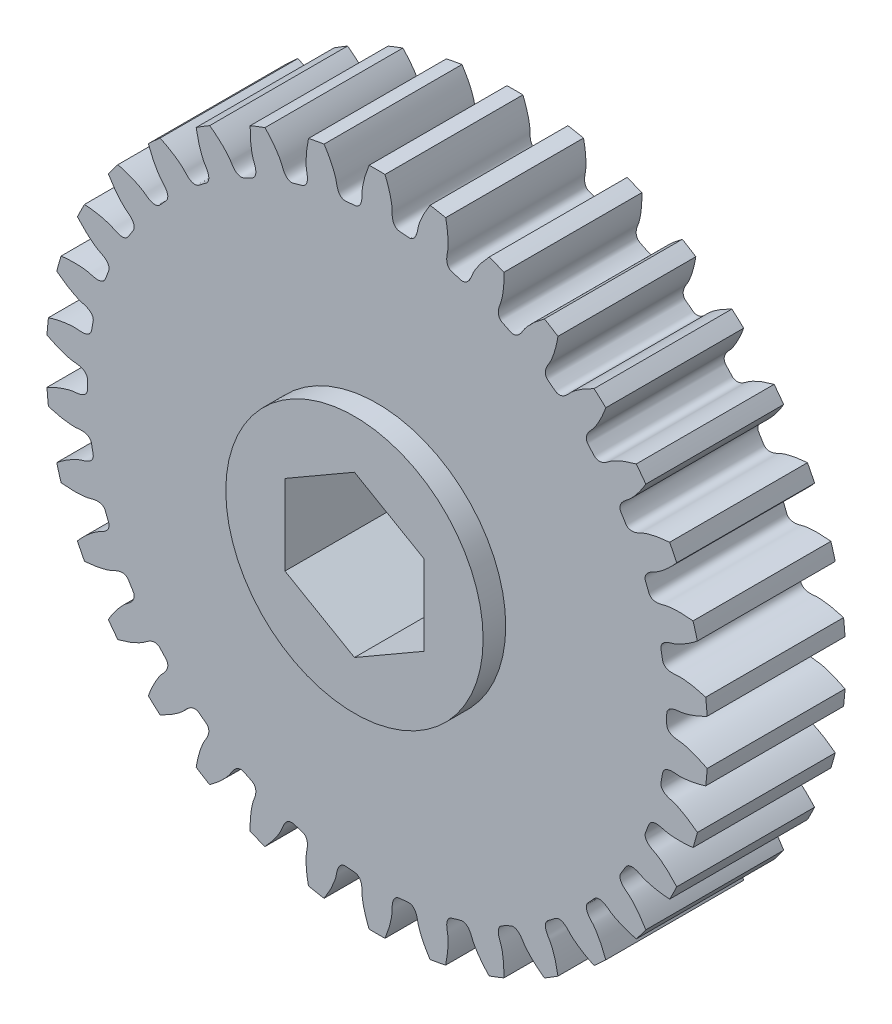
from build123d import *

# Parameters (mm, degrees)
BOSS_EXTRUDE1_DEPTH = 9.525
SKETCH2_R           = 8.89
BOSS_EXTRUDE2_DEPTH = 1.5621
BOSS_EXTRUDE3_START = 1.5621
SKETCH3_R           = 8.89
BOSS_EXTRUDE3_DEPTH = 1.5621
CUT_EXTRUDE1_DEPTH  = 35.680286515


with BuildPart() as part:
    # Sketch1 → Boss-Extrude1 (new body)
    with BuildSketch(Plane.XY.offset(4.7625)):
        with BuildLine():
            ThreePointArc((22.131284072, 5.725893587), (21.98733404, 6.255935888), (21.830691508, 6.782366862))
            add(Edge.make_bspline(
                [(21.830691508, 6.782366862), (21.7017664, 6.797338664), (21.51299978, 6.815268344), (21.267511676, 6.830164759), (21.09855349, 6.836669903), (20.939738832, 6.839268906), (20.791152858, 6.838414063), (20.652865611, 6.834559554), (20.524932058, 6.828160818), (20.407392046, 6.819674157), (20.300270302, 6.809556271), (20.203576438, 6.798263825), (20.117304963, 6.786252979), (20.041435318, 6.773979008), (19.975931903, 6.761895634), (19.920744196, 6.750455243), (19.875806634, 6.740106466), (19.841039264, 6.731299025), (19.794562154, 6.718444128), (19.74568147, 6.702016989), (19.690001251, 6.686227624), (19.646880183, 6.67476173), (19.604660686, 6.664544331), (19.563323219, 6.655508961), (19.522817109, 6.647663599), (19.483085491, 6.641003695), (19.444055964, 6.635536988), (19.405639438, 6.631280473), (19.36772612, 6.628265896), (19.330181431, 6.626544969), (19.292841174, 6.626197431), (19.255506428, 6.627342352), (19.217938877, 6.63015425), (19.1798583, 6.634885846), (19.140945759, 6.641899601), (19.100859314, 6.651709727), (19.059274313, 6.66503374), (19.015968081, 6.68284498), (18.970972215, 6.706399543), (18.924816409, 6.737181303), (18.878800751, 6.776668366), (18.835289087, 6.825858901), (18.799079913, 6.881631168), (18.739348566, 7.016457372), (18.668768055, 7.232319247), (18.575502477, 7.43939288), (18.528812649, 7.579271395), (18.517998018, 7.644881561), (18.517014076, 7.710547424), (18.524417796, 7.770729263), (18.53778981, 7.824572224), (18.55517355, 7.872292775), (18.575177887, 7.91463066), (18.596933244, 7.952492858), (18.619948445, 7.986748692), (18.643980024, 8.018147129), (18.668934254, 8.04729854), (18.694802646, 8.074685653), (18.721622028, 8.100684015), (18.749450945, 8.12558315), (18.778356187, 8.149605063), (18.808405374, 8.172919301), (18.839663125, 8.195654745), (18.87218919, 8.217908822), (18.906037958, 8.239754112), (18.941257721, 8.261245109), (18.977893567, 8.282416761), (19.015977568, 8.303309104), (19.055568945, 8.323886182), (19.10735435, 8.349729221), (19.154544504, 8.370520122), (19.197551791, 8.392331666), (19.229178722, 8.409245514), (19.269359907, 8.431871915), (19.317851455, 8.460597082), (19.37439958, 8.495796726), (19.438736844, 8.537839201), (19.510583889, 8.587083796), (19.589649188, 8.643880813), (19.675629487, 8.708571057), (19.768210031, 8.781485533), (19.867064868, 8.862945088), (19.971857143, 8.953260087), (20.082239407, 9.052730074), (20.197853918, 9.161643504), (20.318333037, 9.280277257), (20.489715285, 9.456670106), (20.617136353, 9.597091549), (20.70232672, 9.695012129)],
                knots=[0, 0, 0, 0, 0.055355065, 0.080847525, 0.104883273, 0.12746231, 0.148584634, 0.168250246, 0.186459146, 0.203211334, 0.218506811, 0.232345575, 0.244727627, 0.255652967, 0.265121596, 0.273133512, 0.279688717, 0.284787209, 0.28842899, 0.300252583, 0.306768976, 0.313109651, 0.319281704, 0.325293427, 0.331154557, 0.336876598, 0.342473219, 0.347960756, 0.353358854, 0.358691273, 0.363986916, 0.369281107, 0.374617178, 0.380048362, 0.385639917, 0.391471197, 0.397636981, 0.404246569, 0.41141794, 0.419262799, 0.42785816, 0.43720457, 0.44718363, 0.456075362, 0.500000009, 0.543924656, 0.552816388, 0.562795448, 0.572141858, 0.580737219, 0.588582078, 0.595753449, 0.602363037, 0.608528821, 0.614360101, 0.619951656, 0.62538284, 0.630718911, 0.636013102, 0.641308744, 0.646641164, 0.652039262, 0.657526799, 0.66312342, 0.668845461, 0.674706591, 0.680718314, 0.686890367, 0.693231042, 0.699747435, 0.711571027, 0.715212808, 0.720311301, 0.726866506, 0.734878422, 0.74434705, 0.755272391, 0.767654443, 0.781493207, 0.796788684, 0.813540872, 0.831749772, 0.851415384, 0.872537708, 0.895116744, 0.919152493, 0.944644953, 1.000000009, 1.000000009, 1.000000009, 1.000000009], degree=3))
            ThreePointArc((20.70232672, 9.695012129), (20.463432693, 10.189578704), (20.212725861, 10.6782632))
            add(Edge.make_bspline(
                [(20.212725861, 10.6782632), (20.083244886, 10.669290152), (19.894397807, 10.65222877), (19.650352396, 10.621763224), (19.483075726, 10.59711162), (19.326487625, 10.570484254), (19.180588685, 10.542341365), (19.045364306, 10.513142271), (18.920784829, 10.483344757), (18.806805579, 10.453404677), (18.703366944, 10.423775499), (18.610394458, 10.394907878), (18.527798905, 10.367249197), (18.455476422, 10.341243203), (18.393308641, 10.31732935), (18.341162776, 10.29594304), (18.298891944, 10.277513215), (18.266334918, 10.262467249), (18.22301125, 10.241291085), (18.177981331, 10.216161847), (18.126150462, 10.190410112), (18.085870464, 10.171215971), (18.046247277, 10.153414731), (18.007273904, 10.136937466), (17.968899069, 10.121782708), (17.931067711, 10.107935536), (17.893707241, 10.095390253), (17.856726962, 10.084147196), (17.820013117, 10.074217394), (17.783423917, 10.06562695), (17.746783309, 10.058424075), (17.709873879, 10.05268926), (17.672429302, 10.048550261), (17.634127691, 10.046204005), (17.594588936, 10.045948177), (17.553382433, 10.048225401), (17.510057215, 10.053681324), (17.464215547, 10.063231794), (17.415657682, 10.078117327), (17.364631632, 10.099893863), (17.31214375, 10.130253228), (17.260334217, 10.170610953), (17.214493446, 10.218780174), (17.131004889, 10.340335099), (17.02196163, 10.539552381), (16.892234395, 10.725962687), (16.82063694, 10.854880271), (16.797950612, 10.917386115), (16.784917354, 10.981753094), (16.781136627, 11.042270653), (16.784387339, 11.097653936), (16.792706459, 11.147756208), (16.804590619, 11.193048997), (16.819018388, 11.234264056), (16.835347219, 11.272165651), (16.853200167, 11.307445261), (16.872372947, 11.340685641), (16.892768511, 11.372359741), (16.914354055, 11.40284348), (16.937133929, 11.43243221), (16.961132989, 11.461356429), (16.986386551, 11.489795221), (17.012934452, 11.517887148), (17.040817523, 11.545738956), (17.070075891, 11.573431983), (17.10074701, 11.601028669), (17.13286878, 11.628571653), (17.166465371, 11.65610618), (17.201601602, 11.683607791), (17.247756616, 11.718526347), (17.290322949, 11.747634411), (17.328590094, 11.77697714), (17.356570606, 11.799414431), (17.391910039, 11.829038848), (17.434297692, 11.866185213), (17.483415059, 11.911176207), (17.538931575, 11.964324771), (17.600506617, 12.025932743), (17.667789254, 12.096290893), (17.740418774, 12.175678501), (17.818024958, 12.2643631), (17.90022845, 12.36260018), (17.9866411, 12.470632924), (18.076866334, 12.588691934), (18.170499498, 12.716995015), (18.267128336, 12.855746784), (18.403180375, 13.060627615), (18.502629484, 13.222071676), (18.568376464, 13.33397866)],
                knots=[0, 0, 0, 0, 0.055355065, 0.080847525, 0.104883273, 0.12746231, 0.148584634, 0.168250246, 0.186459146, 0.203211334, 0.218506811, 0.232345575, 0.244727627, 0.255652967, 0.265121596, 0.273133512, 0.279688717, 0.284787209, 0.28842899, 0.300252583, 0.306768976, 0.313109651, 0.319281704, 0.325293427, 0.331154557, 0.336876598, 0.342473219, 0.347960756, 0.353358854, 0.358691273, 0.363986916, 0.369281107, 0.374617178, 0.380048362, 0.385639917, 0.391471197, 0.397636981, 0.404246569, 0.41141794, 0.419262799, 0.42785816, 0.43720457, 0.44718363, 0.456075362, 0.500000009, 0.543924656, 0.552816388, 0.562795448, 0.572141858, 0.580737219, 0.588582078, 0.595753449, 0.602363037, 0.608528821, 0.614360101, 0.619951656, 0.62538284, 0.630718911, 0.636013102, 0.641308744, 0.646641164, 0.652039262, 0.657526799, 0.66312342, 0.668845461, 0.674706591, 0.680718314, 0.686890367, 0.693231042, 0.699747435, 0.711571027, 0.715212808, 0.720311301, 0.726866506, 0.734878422, 0.74434705, 0.755272391, 0.767654443, 0.781493207, 0.796788684, 0.813540872, 0.831749772, 0.851415384, 0.872537708, 0.895116744, 0.919152493, 0.944644953, 1.000000009, 1.000000009, 1.000000009, 1.000000009], degree=3))
            ThreePointArc((18.568376464, 13.33397866), (18.242673693, 13.776227637), (17.90644008, 14.210524092))
            add(Edge.make_bspline(
                [(17.90644008, 14.210524092), (17.780812558, 14.177911761), (17.59831598, 14.126440321), (17.364023935, 14.051650283), (17.204125189, 13.996681412), (17.055096063, 13.941734438), (16.916852573, 13.887261876), (16.789295965, 13.833712538), (16.672312969, 13.781530964), (16.565775908, 13.731157039), (16.469542859, 13.683025554), (16.383457818, 13.63756581), (16.307350881, 13.595201177), (16.241038414, 13.556348763), (16.184323316, 13.52141879), (16.136995058, 13.490814844), (16.098830439, 13.464931577), (16.069592447, 13.44415946), (16.030897556, 13.415383157), (15.991251843, 13.382407566), (15.945035362, 13.347570407), (15.908968122, 13.321301652), (15.873290564, 13.29652277), (15.838008476, 13.273164723), (15.803071725, 13.251216647), (15.768428929, 13.230653755), (15.734009782, 13.211457111), (15.699725069, 13.19361038), (15.665460943, 13.1771035), (15.631073234, 13.161936077), (15.596380026, 13.148123151), (15.561152819, 13.135703892), (15.525106347, 13.124754944), (15.487888016, 13.115410735), (15.449069492, 13.107894036), (15.408146169, 13.102560811), (15.364556122, 13.099962849), (15.317740101, 13.100927319), (15.267273816, 13.106636914), (15.213115154, 13.11866665), (15.155942459, 13.138864467), (15.09759937, 13.169015048), (15.043688053, 13.207940877), (14.939285389, 13.312085116), (14.795492719, 13.487873699), (14.633721533, 13.647272698), (14.539654618, 13.760839218), (14.505869149, 13.81811218), (14.481230405, 13.878988333), (14.46639398, 13.937780759), (14.459412691, 13.992818353), (14.458383894, 14.043596173), (14.461743175, 14.090301475), (14.468352037, 14.133465865), (14.477438439, 14.173722528), (14.488504795, 14.211681906), (14.501243217, 14.247879295), (14.515471408, 14.282761758), (14.531088045, 14.316692787), (14.548043133, 14.349963504), (14.566318752, 14.382805048), (14.585916711, 14.415399946), (14.606850705, 14.447891718), (14.629141258, 14.480392797), (14.652812866, 14.512990508), (14.677890872, 14.545753112), (14.704404698, 14.578729484), (14.732369788, 14.611968541), (14.761854349, 14.64545815), (14.800807219, 14.688263112), (14.837300187, 14.7246971), (14.869524049, 14.760571783), (14.892905297, 14.787768441), (14.922199538, 14.823382051), (14.957039833, 14.867684639), (14.99705381, 14.920934868), (15.041859029, 14.983379609), (15.091065204, 15.055252973), (15.14427395, 15.136776294), (15.20107938, 15.228157817), (15.261068419, 15.32959249), (15.323821224, 15.441261749), (15.388911569, 15.563333313), (15.455907261, 15.695960988), (15.524370513, 15.839284514), (15.593858492, 15.993429273), (15.689947232, 16.219821115), (15.758037763, 16.39679001), (15.802102421, 16.518872541)],
                knots=[0, 0, 0, 0, 0.055355065, 0.080847525, 0.104883273, 0.12746231, 0.148584634, 0.168250246, 0.186459146, 0.203211334, 0.218506811, 0.232345575, 0.244727627, 0.255652967, 0.265121596, 0.273133512, 0.279688717, 0.284787209, 0.28842899, 0.300252583, 0.306768976, 0.313109651, 0.319281704, 0.325293427, 0.331154557, 0.336876598, 0.342473219, 0.347960756, 0.353358854, 0.358691273, 0.363986916, 0.369281107, 0.374617178, 0.380048362, 0.385639917, 0.391471197, 0.397636981, 0.404246569, 0.41141794, 0.419262799, 0.42785816, 0.43720457, 0.44718363, 0.456075362, 0.500000009, 0.543924656, 0.552816388, 0.562795448, 0.572141858, 0.580737219, 0.588582078, 0.595753449, 0.602363037, 0.608528821, 0.614360101, 0.619951656, 0.62538284, 0.630718911, 0.636013102, 0.641308744, 0.646641164, 0.652039262, 0.657526799, 0.66312342, 0.668845461, 0.674706591, 0.680718314, 0.686890367, 0.693231042, 0.699747435, 0.711571027, 0.715212808, 0.720311301, 0.726866506, 0.734878422, 0.74434705, 0.755272391, 0.767654443, 0.781493207, 0.796788684, 0.813540872, 0.831749772, 0.851415384, 0.872537708, 0.895116744, 0.919152493, 0.944644953, 1.000000009, 1.000000009, 1.000000009, 1.000000009], degree=3))
            ThreePointArc((15.802102421, 16.518872541), (15.400682322, 16.893743661), (14.990371961, 17.25886263))
            add(Edge.make_bspline(
                [(14.990371961, 17.25886263), (14.872875987, 17.203721589), (14.702944612, 17.11959289), (14.486384468, 17.003025244), (14.339308805, 16.919611005), (14.202913664, 16.838215578), (14.077033338, 16.75926834), (13.961488289, 16.683192316), (13.85608549, 16.610403664), (13.760618609, 16.541311316), (13.674868248, 16.476316585), (13.598602174, 16.415812795), (13.531575583, 16.360184887), (13.473531324, 16.309809126), (13.424200275, 16.26505253), (13.383301331, 16.22627313), (13.350542575, 16.193817844), (13.325619282, 16.168026945), (13.292870877, 16.132630446), (13.259959456, 16.092931447), (13.22093121, 16.050195199), (13.190304954, 16.017746382), (13.159787981, 15.986833674), (13.129398668, 15.957390275), (13.09908973, 15.929396295), (13.068815216, 15.902817929), (13.038509493, 15.877623643), (13.008087871, 15.853780986), (12.977440288, 15.831259152), (12.946425102, 15.810031258), (12.91486073, 15.790078663), (12.882515367, 15.771397883), (12.849094517, 15.75401184), (12.814226894, 15.737987883), (12.777450518, 15.723466285), (12.73820397, 15.710704228), (12.695833501, 15.70014085), (12.649637391, 15.692486478), (12.598981255, 15.6888257), (12.543534289, 15.690698979), (12.483623729, 15.700047434), (12.420733886, 15.71896413), (12.360587911, 15.747320994), (12.238826446, 15.830508041), (12.065181053, 15.976881655), (11.876874839, 16.103841206), (11.763541798, 16.198189289), (11.719807712, 16.248279007), (11.684402526, 16.303591271), (11.659015639, 16.358656458), (11.642040088, 16.411474124), (11.631698409, 16.461198314), (11.626418415, 16.507725635), (11.624983313, 16.551369445), (11.626517859, 16.592610284), (11.630420772, 16.631956769), (11.636291046, 16.669878507), (11.643867339, 16.706781454), (11.652983263, 16.743004292), (11.66353618, 16.778824001), (11.675466004, 16.814464491), (11.688740973, 16.850105515), (11.703348179, 16.885890664), (11.719287135, 16.921934228), (11.736565875, 16.958326548), (11.755196768, 16.995139378), (11.775199754, 17.032426167), (11.796581024, 17.070237838), (11.819409855, 17.108574997), (11.849834087, 17.157808695), (11.879010965, 17.200327889), (11.904094199, 17.241512857), (11.922079964, 17.272542734), (11.944331431, 17.312932756), (11.970437925, 17.362882896), (11.999985884, 17.422578988), (12.032554018, 17.492193426), (12.067715668, 17.57188462), (12.105038563, 17.661796933), (12.144085462, 17.762060482), (12.184414502, 17.872790995), (12.225579648, 17.99408967), (12.267131116, 18.126043053), (12.308615807, 18.268722915), (12.349577714, 18.422186176), (12.389558502, 18.58647471), (12.442411757, 18.826668061), (12.476824968, 19.013135326), (12.497706736, 19.141236029)],
                knots=[0, 0, 0, 0, 0.055355065, 0.080847525, 0.104883273, 0.12746231, 0.148584634, 0.168250246, 0.186459146, 0.203211334, 0.218506811, 0.232345575, 0.244727627, 0.255652967, 0.265121596, 0.273133512, 0.279688717, 0.284787209, 0.28842899, 0.300252583, 0.306768976, 0.313109651, 0.319281704, 0.325293427, 0.331154557, 0.336876598, 0.342473219, 0.347960756, 0.353358854, 0.358691273, 0.363986916, 0.369281107, 0.374617178, 0.380048362, 0.385639917, 0.391471197, 0.397636981, 0.404246569, 0.41141794, 0.419262799, 0.42785816, 0.43720457, 0.44718363, 0.456075362, 0.500000009, 0.543924656, 0.552816388, 0.562795448, 0.572141858, 0.580737219, 0.588582078, 0.595753449, 0.602363037, 0.608528821, 0.614360101, 0.619951656, 0.62538284, 0.630718911, 0.636013102, 0.641308744, 0.646641164, 0.652039262, 0.657526799, 0.66312342, 0.668845461, 0.674706591, 0.680718314, 0.686890367, 0.693231042, 0.699747435, 0.711571027, 0.715212808, 0.720311301, 0.726866506, 0.734878422, 0.74434705, 0.755272391, 0.767654443, 0.781493207, 0.796788684, 0.813540872, 0.831749772, 0.851415384, 0.872537708, 0.895116744, 0.919152493, 0.944644953, 1.000000009, 1.000000009, 1.000000009, 1.000000009], degree=3))
            ThreePointArc((12.497706736, 19.141236029), (12.034239189, 19.435963507), (11.563824707, 19.7194713))
            add(Edge.make_bspline(
                [(11.563824707, 19.7194713), (11.458461465, 19.643679311), (11.306882102, 19.529758255), (11.115428555, 19.375382573), (10.986184461, 19.266363538), (10.867068077, 19.161291481), (10.75783762, 19.060558021), (10.658238878, 18.964545988), (10.568005641, 18.873628988), (10.486859951, 18.788171076), (10.414512403, 18.708526416), (10.350662447, 18.635038963), (10.294998712, 18.568042123), (10.247199289, 18.5078585), (10.206932197, 18.454799413), (10.173855331, 18.409165145), (10.147617998, 18.371243067), (10.127858137, 18.341311664), (10.102171425, 18.300500354), (10.077115056, 18.255429848), (10.046604105, 18.206249845), (10.022461773, 18.168725971), (9.998144606, 18.132732131), (9.973682939, 18.09820604), (9.949033948, 18.065119459), (9.924158677, 18.033430712), (9.898998405, 18.003096744), (9.873475845, 17.974070096), (9.847488472, 17.94630026), (9.820901993, 17.919734785), (9.793541345, 17.894321983), (9.765179307, 17.870015835), (9.735522188, 17.846784757), (9.704192646, 17.82462673), (9.670710795, 17.803594748), (9.634477516, 17.783838455), (9.5947695, 17.765669385), (9.550766454, 17.74965683), (9.501645501, 17.736750344), (9.446798411, 17.728403373), (9.386190168, 17.726584117), (9.32089521, 17.733622742), (9.256562774, 17.750444982), (9.12158895, 17.809842001), (8.924004119, 17.921816069), (8.71557542, 18.012012717), (8.586835675, 18.083929452), (8.534642283, 18.12513018), (8.489676336, 18.172994962), (8.454603507, 18.222457731), (8.428211777, 18.271256827), (8.408909388, 18.318234089), (8.395169923, 18.362998998), (8.385739728, 18.40563599), (8.379670161, 18.446456597), (8.376276722, 18.485850292), (8.375078942, 18.524205001), (8.375745335, 18.561871745), (8.378050114, 18.599152867), (8.381841494, 18.63630177), (8.387019267, 18.673527513), (8.393519184, 18.71100095), (8.40130217, 18.748860856), (8.410346748, 18.787219486), (8.420644213, 18.826167117), (8.43219354, 18.865776556), (8.445004507, 18.906104006), (8.459073844, 18.947200659), (8.474469537, 18.989079842), (8.49532907, 19.04306568), (8.516196275, 19.090222142), (8.533284701, 19.135314889), (8.5452625, 19.169121299), (8.559713446, 19.212912301), (8.576197113, 19.266809), (8.594272834, 19.330918077), (8.613494814, 19.405331576), (8.633414552, 19.490126812), (8.65358061, 19.585366261), (8.673539282, 19.691097481), (8.692834965, 19.807353038), (8.711010623, 19.934150449), (8.727608228, 20.071492137), (8.742169207, 20.219365395), (8.754234859, 20.377742383), (8.76334696, 20.546580043), (8.771164875, 20.792395405), (8.770728866, 20.982011122), (8.76771664, 21.111767682)],
                knots=[0, 0, 0, 0, 0.055355065, 0.080847525, 0.104883273, 0.12746231, 0.148584634, 0.168250246, 0.186459146, 0.203211334, 0.218506811, 0.232345575, 0.244727627, 0.255652967, 0.265121596, 0.273133512, 0.279688717, 0.284787209, 0.28842899, 0.300252583, 0.306768976, 0.313109651, 0.319281704, 0.325293427, 0.331154557, 0.336876598, 0.342473219, 0.347960756, 0.353358854, 0.358691273, 0.363986916, 0.369281107, 0.374617178, 0.380048362, 0.385639917, 0.391471197, 0.397636981, 0.404246569, 0.41141794, 0.419262799, 0.42785816, 0.43720457, 0.44718363, 0.456075362, 0.500000009, 0.543924656, 0.552816388, 0.562795448, 0.572141858, 0.580737219, 0.588582078, 0.595753449, 0.602363037, 0.608528821, 0.614360101, 0.619951656, 0.62538284, 0.630718911, 0.636013102, 0.641308744, 0.646641164, 0.652039262, 0.657526799, 0.66312342, 0.668845461, 0.674706591, 0.680718314, 0.686890367, 0.693231042, 0.699747435, 0.711571027, 0.715212808, 0.720311301, 0.726866506, 0.734878422, 0.74434705, 0.755272391, 0.767654443, 0.781493207, 0.796788684, 0.813540872, 0.831749772, 0.851415384, 0.872537708, 0.895116744, 0.919152493, 0.944644953, 1.000000009, 1.000000009, 1.000000009, 1.000000009], degree=3))
            ThreePointArc((8.76771664, 21.111767682), (8.257984477, 21.316314926), (7.743485275, 21.508557026))
            add(Edge.make_bspline(
                [(7.743485275, 21.508557026), (7.653842783, 21.414695095), (7.525777287, 21.274861127), (7.365950057, 21.087934487), (7.258938785, 20.957023168), (7.161157523, 20.831852584), (7.072296647, 20.712763259), (6.992035927, 20.600084793), (6.920045038, 20.494135514), (6.855983858, 20.395222203), (6.799502832, 20.303639818), (6.750243326, 20.21967123), (6.707838009, 20.143586954), (6.671911174, 20.075644951), (6.642079288, 20.016090237), (6.617950893, 19.965155121), (6.599128464, 19.923057641), (6.585204933, 19.890005012), (6.567454645, 19.845168671), (6.551106592, 19.79626148), (6.530151949, 19.742312488), (6.513315681, 19.700991387), (6.49602641, 19.661142143), (6.478325402, 19.622709105), (6.460175751, 19.585656645), (6.44154682, 19.549936641), (6.422388801, 19.515495979), (6.402634444, 19.482273806), (6.38219225, 19.450201637), (6.360939849, 19.419203238), (6.338714658, 19.389195631), (6.315301781, 19.360091829), (6.29041833, 19.331806824), (6.26369376, 19.304269291), (6.234646618, 19.277443144), (6.202660489, 19.251365392), (6.166967134, 19.226209357), (6.126655623, 19.202383907), (6.080742609, 19.180671227), (6.028363146, 19.162388254), (5.969121161, 19.149463238), (5.90364463, 19.1443841), (5.837316498, 19.149098856), (5.693726686, 19.182683152), (5.478930931, 19.256444531), (5.257477536, 19.306806737), (5.117715164, 19.353843087), (5.05883985, 19.384751784), (5.005844403, 19.423539105), (4.962279996, 19.465715062), (4.927370825, 19.508833793), (4.899765047, 19.551464373), (4.878033992, 19.592942455), (4.860929836, 19.633120676), (4.847462849, 19.672130955), (4.836888617, 19.710230355), (4.828663572, 19.74771191), (4.822397373, 19.784859756), (4.817812521, 19.821929598), (4.814713252, 19.859142635), (4.812962651, 19.896685952), (4.812466168, 19.934715689), (4.813159895, 19.973361078), (4.815002092, 20.012728516), (4.817967615, 20.052905145), (4.822042077, 20.093962341), (4.827224764, 20.135957148), (4.833503053, 20.178939287), (4.840941326, 20.222934348), (4.851525814, 20.279833904), (4.863372737, 20.330021776), (4.87188443, 20.377486724), (4.877446373, 20.41291843), (4.883604689, 20.458619161), (4.889904197, 20.514627033), (4.895892133, 20.580965935), (4.901113378, 20.657644432), (4.90511286, 20.74465611), (4.90743535, 20.841979431), (4.907626127, 20.949577772), (4.905231362, 21.06739943), (4.899798582, 21.195377642), (4.890877112, 21.333430629), (4.878018523, 21.481461637), (4.860777039, 21.639359013), (4.838710151, 21.806996235), (4.801226497, 22.050062662), (4.765956115, 22.236369694), (4.739152472, 22.363363407)],
                knots=[0, 0, 0, 0, 0.055355065, 0.080847525, 0.104883273, 0.12746231, 0.148584634, 0.168250246, 0.186459146, 0.203211334, 0.218506811, 0.232345575, 0.244727627, 0.255652967, 0.265121596, 0.273133512, 0.279688717, 0.284787209, 0.28842899, 0.300252583, 0.306768976, 0.313109651, 0.319281704, 0.325293427, 0.331154557, 0.336876598, 0.342473219, 0.347960756, 0.353358854, 0.358691273, 0.363986916, 0.369281107, 0.374617178, 0.380048362, 0.385639917, 0.391471197, 0.397636981, 0.404246569, 0.41141794, 0.419262799, 0.42785816, 0.43720457, 0.44718363, 0.456075362, 0.500000009, 0.543924656, 0.552816388, 0.562795448, 0.572141858, 0.580737219, 0.588582078, 0.595753449, 0.602363037, 0.608528821, 0.614360101, 0.619951656, 0.62538284, 0.630718911, 0.636013102, 0.641308744, 0.646641164, 0.652039262, 0.657526799, 0.66312342, 0.668845461, 0.674706591, 0.680718314, 0.686890367, 0.693231042, 0.699747435, 0.711571027, 0.715212808, 0.720311301, 0.726866506, 0.734878422, 0.74434705, 0.755272391, 0.767654443, 0.781493207, 0.796788684, 0.813540872, 0.831749772, 0.851415384, 0.872537708, 0.895116744, 0.919152493, 0.944644953, 1.000000009, 1.000000009, 1.000000009, 1.000000009], degree=3))
            ThreePointArc((4.739152472, 22.363363407), (4.20051401, 22.470764807), (3.659450742, 22.56519464))
            add(Edge.make_bspline(
                [(3.659450742, 22.56519464), (3.588581669, 22.456459121), (3.488391155, 22.295474119), (3.365632968, 22.082362084), (3.284498658, 21.934016509), (3.211382341, 21.793009933), (3.145917097, 21.659620187), (3.087727582, 21.534112417), (3.036430604, 21.416738834), (2.99163546, 21.3077385), (2.95294435, 21.207337118), (2.919952769, 21.115746844), (2.892249932, 21.033166091), (2.869419129, 20.959779391), (2.851038338, 20.895757115), (2.836680078, 20.841255685), (2.825913528, 20.796416382), (2.818300476, 20.761368094), (2.809091077, 20.714033571), (2.802008053, 20.662955171), (2.791323304, 20.606074357), (2.782366438, 20.562363171), (2.772693829, 20.52001554), (2.762356266, 20.478984346), (2.751324019, 20.439227785), (2.739575815, 20.400692924), (2.727072453, 20.363318404), (2.713759009, 20.327032048), (2.699558128, 20.291749725), (2.684363531, 20.257374014), (2.668030649, 20.223793476), (2.65036423, 20.190883117), (2.631101823, 20.158507395), (2.609892298, 20.126528114), (2.58626903, 20.094821336), (2.5596193, 20.063310171), (2.529156102, 20.032023828), (2.493908886, 20.001196832), (2.452767323, 19.971417357), (2.404639207, 19.943820985), (2.348780895, 19.920230355), (2.285352516, 19.903206419), (2.219287412, 19.895653134), (2.071971391, 19.902281036), (1.847279324, 19.93531787), (1.620342563, 19.944130609), (1.474317004, 19.964684808), (1.410764696, 19.984248915), (1.351544446, 20.012637921), (1.300971994, 20.046090812), (1.258734172, 20.082060822), (1.223765086, 20.118892987), (1.194782466, 20.155671755), (1.170586813, 20.192022986), (1.150181006, 20.227894488), (1.132786074, 20.263402163), (1.117813859, 20.298734175), (1.104828455, 20.334098097), (1.093510103, 20.36969429), (1.083625727, 20.405704215), (1.075006367, 20.442286614), (1.067530392, 20.479577594), (1.061111236, 20.517692444), (1.055688318, 20.556728079), (1.051220911, 20.596765538), (1.047681758, 20.637872338), (1.045059674, 20.68010442), (1.043333116, 20.723508339), (1.042560666, 20.768121079), (1.042509668, 20.825996706), (1.044932878, 20.877506901), (1.044577981, 20.925727688), (1.043534662, 20.961578106), (1.041190634, 21.007632283), (1.037091462, 21.063844046), (1.0307877, 21.130153682), (1.021830407, 21.206485984), (1.009773437, 21.292751026), (0.994173268, 21.388843988), (0.974589654, 21.494645318), (0.950585991, 21.610020801), (0.92172978, 21.734821671), (0.887593045, 21.868884727), (0.847752772, 22.012032467), (0.80179129, 22.164073226), (0.749296874, 22.324801325), (0.667788111, 22.556841481), (0.598884448, 22.733495366), (0.549202154, 22.853401614)],
                knots=[0, 0, 0, 0, 0.055355065, 0.080847525, 0.104883273, 0.12746231, 0.148584634, 0.168250246, 0.186459146, 0.203211334, 0.218506811, 0.232345575, 0.244727627, 0.255652967, 0.265121596, 0.273133512, 0.279688717, 0.284787209, 0.28842899, 0.300252583, 0.306768976, 0.313109651, 0.319281704, 0.325293427, 0.331154557, 0.336876598, 0.342473219, 0.347960756, 0.353358854, 0.358691273, 0.363986916, 0.369281107, 0.374617178, 0.380048362, 0.385639917, 0.391471197, 0.397636981, 0.404246569, 0.41141794, 0.419262799, 0.42785816, 0.43720457, 0.44718363, 0.456075362, 0.500000009, 0.543924656, 0.552816388, 0.562795448, 0.572141858, 0.580737219, 0.588582078, 0.595753449, 0.602363037, 0.608528821, 0.614360101, 0.619951656, 0.62538284, 0.630718911, 0.636013102, 0.641308744, 0.646641164, 0.652039262, 0.657526799, 0.66312342, 0.668845461, 0.674706591, 0.680718314, 0.686890367, 0.693231042, 0.699747435, 0.711571027, 0.715212808, 0.720311301, 0.726866506, 0.734878422, 0.74434705, 0.755272391, 0.767654443, 0.781493207, 0.796788684, 0.813540872, 0.831749772, 0.851415384, 0.872537708, 0.895116744, 0.919152493, 0.944644953, 1.000000009, 1.000000009, 1.000000009, 1.000000009], degree=3))
            ThreePointArc((0.549202154, 22.853401614), (8e-08, 22.859999743), (-0.549201994, 22.853401613))
            add(Edge.make_bspline(
                [(-0.549201994, 22.853401613), (-0.598884288, 22.733495366), (-0.667787951, 22.556841481), (-0.749296713, 22.324801325), (-0.80179113, 22.164073225), (-0.847752611, 22.012032466), (-0.887592884, 21.868884727), (-0.921729619, 21.73482167), (-0.95058583, 21.610020801), (-0.974589493, 21.494645318), (-0.994173107, 21.388843987), (-1.009773276, 21.292751025), (-1.021830245, 21.206485983), (-1.030787539, 21.130153682), (-1.037091301, 21.063844045), (-1.041190472, 21.007632283), (-1.043534501, 20.961578106), (-1.04457782, 20.925727687), (-1.044932716, 20.877506901), (-1.042509506, 20.825996706), (-1.042560505, 20.768121078), (-1.043332955, 20.723508338), (-1.045059512, 20.680104419), (-1.047681596, 20.637872338), (-1.051220749, 20.596765537), (-1.055688156, 20.556728079), (-1.061111074, 20.517692444), (-1.067530231, 20.479577593), (-1.075006205, 20.442286614), (-1.083625565, 20.405704215), (-1.093509941, 20.36969429), (-1.104828293, 20.334098096), (-1.117813697, 20.298734175), (-1.132785913, 20.263402162), (-1.150180844, 20.227894487), (-1.170586651, 20.192022985), (-1.194782304, 20.155671754), (-1.223764924, 20.118892986), (-1.25873401, 20.082060821), (-1.300971833, 20.046090812), (-1.351544284, 20.01263792), (-1.410764535, 19.984248914), (-1.474316843, 19.964684808), (-1.620342401, 19.944130609), (-1.847279162, 19.93531787), (-2.071971229, 19.902281034), (-2.21928725, 19.895653133), (-2.285352354, 19.903206417), (-2.348780733, 19.920230354), (-2.404639046, 19.943820983), (-2.452767161, 19.971417355), (-2.493908724, 20.00119683), (-2.529155941, 20.032023827), (-2.559619138, 20.06331017), (-2.586268869, 20.094821334), (-2.609892137, 20.126528113), (-2.631101662, 20.158507394), (-2.650364068, 20.190883116), (-2.668030487, 20.223793474), (-2.684363369, 20.257374013), (-2.699557966, 20.291749724), (-2.713758848, 20.327032047), (-2.727072291, 20.363318402), (-2.739575653, 20.400692923), (-2.751323857, 20.439227784), (-2.762356104, 20.478984345), (-2.772693667, 20.520015539), (-2.782366276, 20.562363169), (-2.791323143, 20.606074356), (-2.802007892, 20.662955169), (-2.809090915, 20.714033569), (-2.818300315, 20.761368093), (-2.825913367, 20.796416381), (-2.836679916, 20.841255684), (-2.851038176, 20.895757113), (-2.869418968, 20.959779389), (-2.892249771, 21.03316609), (-2.919952608, 21.115746843), (-2.952944189, 21.207337116), (-2.991635299, 21.307738498), (-3.036430443, 21.416738833), (-3.087727421, 21.534112416), (-3.145916936, 21.659620185), (-3.21138218, 21.793009931), (-3.284498497, 21.934016508), (-3.365632807, 22.082362082), (-3.488390994, 22.295474117), (-3.588581508, 22.45645912), (-3.659450582, 22.565194638)],
                knots=[0, 0, 0, 0, 0.055355065, 0.080847525, 0.104883273, 0.12746231, 0.148584634, 0.168250246, 0.186459146, 0.203211334, 0.218506811, 0.232345575, 0.244727627, 0.255652967, 0.265121596, 0.273133512, 0.279688717, 0.284787209, 0.28842899, 0.300252583, 0.306768976, 0.313109651, 0.319281704, 0.325293427, 0.331154557, 0.336876598, 0.342473219, 0.347960756, 0.353358854, 0.358691273, 0.363986916, 0.369281107, 0.374617178, 0.380048362, 0.385639917, 0.391471197, 0.397636981, 0.404246569, 0.41141794, 0.419262799, 0.42785816, 0.43720457, 0.44718363, 0.456075362, 0.500000009, 0.543924656, 0.552816388, 0.562795448, 0.572141858, 0.580737219, 0.588582078, 0.595753449, 0.602363037, 0.608528821, 0.614360101, 0.619951656, 0.62538284, 0.630718911, 0.636013102, 0.641308744, 0.646641164, 0.652039262, 0.657526799, 0.66312342, 0.668845461, 0.674706591, 0.680718314, 0.686890367, 0.693231042, 0.699747435, 0.711571027, 0.715212808, 0.720311301, 0.726866506, 0.734878422, 0.74434705, 0.755272391, 0.767654443, 0.781493207, 0.796788684, 0.813540872, 0.831749772, 0.851415384, 0.872537708, 0.895116744, 0.919152493, 0.944644953, 1.000000009, 1.000000009, 1.000000009, 1.000000009], degree=3))
            ThreePointArc((-3.659450582, 22.565194638), (-4.20051385, 22.470764805), (-4.739152311, 22.363363405))
            add(Edge.make_bspline(
                [(-4.739152311, 22.363363405), (-4.765955955, 22.236369692), (-4.801226336, 22.05006266), (-4.83870999, 21.806996233), (-4.860776879, 21.639359011), (-4.878018362, 21.481461634), (-4.890876951, 21.333430626), (-4.899798421, 21.195377639), (-4.9052312, 21.067399427), (-4.907625966, 20.94957777), (-4.907435189, 20.841979428), (-4.905112699, 20.744656108), (-4.901113216, 20.65764443), (-4.895891971, 20.580965932), (-4.889904036, 20.51462703), (-4.883604527, 20.458619159), (-4.877446211, 20.412918428), (-4.871884269, 20.377486721), (-4.863372576, 20.330021773), (-4.851525652, 20.279833901), (-4.840941164, 20.222934345), (-4.833502892, 20.178939284), (-4.827224602, 20.135957146), (-4.822041916, 20.093962339), (-4.817967453, 20.052905142), (-4.81500193, 20.012728514), (-4.813159734, 19.973361076), (-4.812466006, 19.934715686), (-4.812962489, 19.89668595), (-4.81471309, 19.859142632), (-4.817812359, 19.821929595), (-4.822397211, 19.784859753), (-4.82866341, 19.747711908), (-4.836888455, 19.710230352), (-4.847462687, 19.672130953), (-4.860929674, 19.633120674), (-4.87803383, 19.592942452), (-4.899764884, 19.551464371), (-4.927370663, 19.50883379), (-4.962279834, 19.465715059), (-5.005844241, 19.423539103), (-5.058839688, 19.384751781), (-5.117715002, 19.353843085), (-5.257477374, 19.306806734), (-5.478930768, 19.256444528), (-5.693726524, 19.182683149), (-5.837316335, 19.149098853), (-5.903644468, 19.144384097), (-5.969120999, 19.149463235), (-6.028362984, 19.162388251), (-6.080742447, 19.180671224), (-6.126655461, 19.202383904), (-6.166966972, 19.226209354), (-6.202660326, 19.251365389), (-6.234646456, 19.277443141), (-6.263693598, 19.304269288), (-6.290418168, 19.33180682), (-6.315301619, 19.360091826), (-6.338714496, 19.389195627), (-6.360939687, 19.419203234), (-6.382192088, 19.450201634), (-6.402634282, 19.482273803), (-6.422388639, 19.515495975), (-6.441546658, 19.549936637), (-6.460175589, 19.585656642), (-6.47832524, 19.622709102), (-6.496026248, 19.66114214), (-6.513315519, 19.700991384), (-6.530151787, 19.742312484), (-6.55110643, 19.796261477), (-6.567454483, 19.845168667), (-6.585204771, 19.890005008), (-6.599128302, 19.923057638), (-6.617950731, 19.965155118), (-6.642079126, 20.016090234), (-6.671911012, 20.075644947), (-6.707837848, 20.143586951), (-6.750243165, 20.219671227), (-6.79950267, 20.303639815), (-6.855983696, 20.3952222), (-6.920044877, 20.49413551), (-6.992035766, 20.600084789), (-7.072296485, 20.712763255), (-7.161157361, 20.831852581), (-7.258938624, 20.957023164), (-7.365949896, 21.087934483), (-7.525777126, 21.274861123), (-7.653842622, 21.414695091), (-7.743485114, 21.508557022)],
                knots=[0, 0, 0, 0, 0.055355065, 0.080847525, 0.104883273, 0.12746231, 0.148584634, 0.168250246, 0.186459146, 0.203211334, 0.218506811, 0.232345575, 0.244727627, 0.255652967, 0.265121596, 0.273133512, 0.279688717, 0.284787209, 0.28842899, 0.300252583, 0.306768976, 0.313109651, 0.319281704, 0.325293427, 0.331154557, 0.336876598, 0.342473219, 0.347960756, 0.353358854, 0.358691273, 0.363986916, 0.369281107, 0.374617178, 0.380048362, 0.385639917, 0.391471197, 0.397636981, 0.404246569, 0.41141794, 0.419262799, 0.42785816, 0.43720457, 0.44718363, 0.456075362, 0.500000009, 0.543924656, 0.552816388, 0.562795448, 0.572141858, 0.580737219, 0.588582078, 0.595753449, 0.602363037, 0.608528821, 0.614360101, 0.619951656, 0.62538284, 0.630718911, 0.636013102, 0.641308744, 0.646641164, 0.652039262, 0.657526799, 0.66312342, 0.668845461, 0.674706591, 0.680718314, 0.686890367, 0.693231042, 0.699747435, 0.711571027, 0.715212808, 0.720311301, 0.726866506, 0.734878422, 0.74434705, 0.755272391, 0.767654443, 0.781493207, 0.796788684, 0.813540872, 0.831749772, 0.851415384, 0.872537708, 0.895116744, 0.919152493, 0.944644953, 1.000000009, 1.000000009, 1.000000009, 1.000000009], degree=3))
            ThreePointArc((-7.743485114, 21.508557022), (-8.257984315, 21.316314922), (-8.767716478, 21.111767678))
            add(Edge.make_bspline(
                [(-8.767716478, 21.111767678), (-8.770728705, 20.982011117), (-8.771164714, 20.792395401), (-8.763346799, 20.546580038), (-8.754234698, 20.377742379), (-8.742169046, 20.219365391), (-8.727608066, 20.071492132), (-8.711010462, 19.934150444), (-8.692834803, 19.807353033), (-8.67353912, 19.691097477), (-8.653580448, 19.585366257), (-8.63341439, 19.490126807), (-8.613494652, 19.405331571), (-8.594272672, 19.330918072), (-8.576196951, 19.266808996), (-8.559713284, 19.212912297), (-8.545262338, 19.169121295), (-8.533284539, 19.135314885), (-8.516196112, 19.090222138), (-8.495328908, 19.043065676), (-8.474469375, 18.989079838), (-8.459073682, 18.947200655), (-8.445004345, 18.906104002), (-8.432193378, 18.865776552), (-8.420644051, 18.826167113), (-8.410346585, 18.787219481), (-8.401302008, 18.748860852), (-8.393519021, 18.711000945), (-8.387019104, 18.673527509), (-8.381841331, 18.636301766), (-8.378049952, 18.599152862), (-8.375745173, 18.56187174), (-8.375078779, 18.524204997), (-8.376276559, 18.485850288), (-8.379669998, 18.446456593), (-8.385739565, 18.405635986), (-8.395169761, 18.362998994), (-8.408909225, 18.318234085), (-8.428211614, 18.271256823), (-8.454603345, 18.222457727), (-8.489676173, 18.172994957), (-8.53464212, 18.125130176), (-8.586835512, 18.083929448), (-8.715575257, 18.012012712), (-8.924003956, 17.921816064), (-9.121588787, 17.809841996), (-9.256562611, 17.750444978), (-9.320895047, 17.733622737), (-9.386190005, 17.726584112), (-9.446798248, 17.728403369), (-9.501645338, 17.736750339), (-9.550766291, 17.749656825), (-9.594769337, 17.76566938), (-9.634477353, 17.78383845), (-9.670710632, 17.803594743), (-9.704192483, 17.824626725), (-9.735522025, 17.846784752), (-9.765179144, 17.87001583), (-9.793541182, 17.894321978), (-9.82090183, 17.91973478), (-9.847488309, 17.946300255), (-9.873475682, 17.974070091), (-9.898998242, 18.003096739), (-9.924158514, 18.033430707), (-9.949033786, 18.065119453), (-9.973682776, 18.098206035), (-9.998144443, 18.132732126), (-10.022461611, 18.168725966), (-10.046603942, 18.20624984), (-10.077114894, 18.255429842), (-10.102171263, 18.300500348), (-10.127857974, 18.341311658), (-10.147617835, 18.371243062), (-10.173855169, 18.40916514), (-10.206932034, 18.454799408), (-10.247199126, 18.507858495), (-10.294998549, 18.568042118), (-10.350662284, 18.635038958), (-10.414512241, 18.708526411), (-10.486859789, 18.78817107), (-10.568005479, 18.873628983), (-10.658238715, 18.964545983), (-10.757837458, 19.060558015), (-10.867067914, 19.161291475), (-10.986184299, 19.266363532), (-11.115428393, 19.375382567), (-11.30688194, 19.52975825), (-11.458461303, 19.643679305), (-11.563824546, 19.719471294)],
                knots=[0, 0, 0, 0, 0.055355065, 0.080847525, 0.104883273, 0.12746231, 0.148584634, 0.168250246, 0.186459146, 0.203211334, 0.218506811, 0.232345575, 0.244727627, 0.255652967, 0.265121596, 0.273133512, 0.279688717, 0.284787209, 0.28842899, 0.300252583, 0.306768976, 0.313109651, 0.319281704, 0.325293427, 0.331154557, 0.336876598, 0.342473219, 0.347960756, 0.353358854, 0.358691273, 0.363986916, 0.369281107, 0.374617178, 0.380048362, 0.385639917, 0.391471197, 0.397636981, 0.404246569, 0.41141794, 0.419262799, 0.42785816, 0.43720457, 0.44718363, 0.456075362, 0.500000009, 0.543924656, 0.552816388, 0.562795448, 0.572141858, 0.580737219, 0.588582078, 0.595753449, 0.602363037, 0.608528821, 0.614360101, 0.619951656, 0.62538284, 0.630718911, 0.636013102, 0.641308744, 0.646641164, 0.652039262, 0.657526799, 0.66312342, 0.668845461, 0.674706591, 0.680718314, 0.686890367, 0.693231042, 0.699747435, 0.711571027, 0.715212808, 0.720311301, 0.726866506, 0.734878422, 0.74434705, 0.755272391, 0.767654443, 0.781493207, 0.796788684, 0.813540872, 0.831749772, 0.851415384, 0.872537708, 0.895116744, 0.919152493, 0.944644953, 1.000000009, 1.000000009, 1.000000009, 1.000000009], degree=3))
            ThreePointArc((-11.563824546, 19.719471294), (-12.034239027, 19.435963501), (-12.497706573, 19.141236023))
            add(Edge.make_bspline(
                [(-12.497706573, 19.141236023), (-12.476824806, 19.013135319), (-12.442411594, 18.826668054), (-12.38955834, 18.586474703), (-12.349577551, 18.42218617), (-12.308615645, 18.268722909), (-12.267130953, 18.126043047), (-12.225579485, 17.994089664), (-12.184414339, 17.872790988), (-12.144085299, 17.762060476), (-12.1050384, 17.661796927), (-12.067715505, 17.571884614), (-12.032553855, 17.49219342), (-11.999985721, 17.422578982), (-11.970437762, 17.36288289), (-11.944331268, 17.31293275), (-11.922079801, 17.272542728), (-11.904094036, 17.241512851), (-11.879010801, 17.200327883), (-11.849833924, 17.157808688), (-11.819409692, 17.108574991), (-11.79658086, 17.070237832), (-11.77519959, 17.032426161), (-11.755196605, 16.995139372), (-11.736565712, 16.958326542), (-11.719286972, 16.921934222), (-11.703348016, 16.885890658), (-11.68874081, 16.850105509), (-11.67546584, 16.814464485), (-11.663536016, 16.778823995), (-11.652983099, 16.743004286), (-11.643867175, 16.706781448), (-11.636290882, 16.669878501), (-11.630420608, 16.631956763), (-11.626517696, 16.592610278), (-11.624983149, 16.551369439), (-11.626418251, 16.507725629), (-11.631698245, 16.461198308), (-11.642039925, 16.411474118), (-11.659015475, 16.358656452), (-11.684402362, 16.303591265), (-11.719807548, 16.248279001), (-11.763541635, 16.198189283), (-11.876874676, 16.1038412), (-12.065180889, 15.976881649), (-12.238826282, 15.830508035), (-12.360587747, 15.747320988), (-12.420733722, 15.718964124), (-12.483623565, 15.700047428), (-12.543534125, 15.690698973), (-12.598981091, 15.688825693), (-12.649637227, 15.692486471), (-12.695833337, 15.700140844), (-12.738203806, 15.710704221), (-12.777450354, 15.723466278), (-12.81422673, 15.737987877), (-12.849094354, 15.754011833), (-12.882515203, 15.771397876), (-12.914860566, 15.790078656), (-12.946424938, 15.810031251), (-12.977440125, 15.831259145), (-13.008087707, 15.85378098), (-13.038509329, 15.877623636), (-13.068815052, 15.902817922), (-13.099089566, 15.929396289), (-13.129398504, 15.957390269), (-13.159787817, 15.986833667), (-13.19030479, 16.017746376), (-13.220931046, 16.050195193), (-13.259959293, 16.09293144), (-13.292870713, 16.132630439), (-13.325619118, 16.168026938), (-13.350542411, 16.193817838), (-13.383301167, 16.226273123), (-13.424200111, 16.265052523), (-13.473531161, 16.309809119), (-13.53157542, 16.36018488), (-13.598602011, 16.415812788), (-13.674868084, 16.476316578), (-13.760618446, 16.541311309), (-13.856085327, 16.610403656), (-13.961488126, 16.683192308), (-14.077033175, 16.759268333), (-14.2029135, 16.83821557), (-14.339308642, 16.919610997), (-14.486384304, 17.003025236), (-14.702944449, 17.119592882), (-14.872875823, 17.203721581), (-14.990371798, 17.258862622)],
                knots=[0, 0, 0, 0, 0.055355065, 0.080847525, 0.104883273, 0.12746231, 0.148584634, 0.168250246, 0.186459146, 0.203211334, 0.218506811, 0.232345575, 0.244727627, 0.255652967, 0.265121596, 0.273133512, 0.279688717, 0.284787209, 0.28842899, 0.300252583, 0.306768976, 0.313109651, 0.319281704, 0.325293427, 0.331154557, 0.336876598, 0.342473219, 0.347960756, 0.353358854, 0.358691273, 0.363986916, 0.369281107, 0.374617178, 0.380048362, 0.385639917, 0.391471197, 0.397636981, 0.404246569, 0.41141794, 0.419262799, 0.42785816, 0.43720457, 0.44718363, 0.456075362, 0.500000009, 0.543924656, 0.552816388, 0.562795448, 0.572141858, 0.580737219, 0.588582078, 0.595753449, 0.602363037, 0.608528821, 0.614360101, 0.619951656, 0.62538284, 0.630718911, 0.636013102, 0.641308744, 0.646641164, 0.652039262, 0.657526799, 0.66312342, 0.668845461, 0.674706591, 0.680718314, 0.686890367, 0.693231042, 0.699747435, 0.711571027, 0.715212808, 0.720311301, 0.726866506, 0.734878422, 0.74434705, 0.755272391, 0.767654443, 0.781493207, 0.796788684, 0.813540872, 0.831749772, 0.851415384, 0.872537708, 0.895116744, 0.919152493, 0.944644953, 1.000000009, 1.000000009, 1.000000009, 1.000000009], degree=3))
            ThreePointArc((-14.990371798, 17.258862622), (-15.400682159, 16.893743653), (-15.802102258, 16.518872533))
            add(Edge.make_bspline(
                [(-15.802102258, 16.518872533), (-15.758037599, 16.396790002), (-15.689947068, 16.219821107), (-15.593858328, 15.993429265), (-15.52437035, 15.839284506), (-15.455907097, 15.69596098), (-15.388911405, 15.563333305), (-15.32382106, 15.441261741), (-15.261068255, 15.329592483), (-15.201079216, 15.228157809), (-15.144273786, 15.136776287), (-15.09106504, 15.055252965), (-15.041858865, 14.983379602), (-14.997053646, 14.920934861), (-14.957039668, 14.867684631), (-14.922199373, 14.823382043), (-14.892905133, 14.787768434), (-14.869523884, 14.760571775), (-14.837300022, 14.724697092), (-14.800807054, 14.688263105), (-14.761854185, 14.645458142), (-14.732369623, 14.611968534), (-14.704404534, 14.578729476), (-14.677890708, 14.545753105), (-14.652812701, 14.512990501), (-14.629141093, 14.480392789), (-14.606850541, 14.44789171), (-14.585916546, 14.415399939), (-14.566318587, 14.382805041), (-14.548042968, 14.349963496), (-14.53108788, 14.316692779), (-14.515471243, 14.282761751), (-14.501243053, 14.247879287), (-14.48850463, 14.211681899), (-14.477438274, 14.173722521), (-14.468351872, 14.133465857), (-14.46174301, 14.090301467), (-14.458383729, 14.043596165), (-14.459412526, 13.992818346), (-14.466393815, 13.937780751), (-14.48123024, 13.878988325), (-14.505868984, 13.818112172), (-14.539654453, 13.76083921), (-14.633721368, 13.647272691), (-14.795492554, 13.487873691), (-14.939285224, 13.312085109), (-15.043687888, 13.207940869), (-15.097599204, 13.169015041), (-15.155942294, 13.138864459), (-15.213114989, 13.118666643), (-15.267273651, 13.106636906), (-15.317739936, 13.100927312), (-15.364555956, 13.099962841), (-15.408146004, 13.102560803), (-15.449069326, 13.107894028), (-15.487887851, 13.115410727), (-15.525106181, 13.124754936), (-15.561152654, 13.135703884), (-15.596379861, 13.148123143), (-15.631073068, 13.161936069), (-15.665460778, 13.177103492), (-15.699724903, 13.193610372), (-15.734009617, 13.211457103), (-15.768428764, 13.230653747), (-15.80307156, 13.251216638), (-15.838008311, 13.273164715), (-15.873290398, 13.296522762), (-15.908967957, 13.321301644), (-15.945035197, 13.347570398), (-15.991251678, 13.382407558), (-16.030897391, 13.415383149), (-16.069592282, 13.444159452), (-16.098830274, 13.464931569), (-16.136994893, 13.490814836), (-16.184323151, 13.521418782), (-16.241038249, 13.556348755), (-16.307350715, 13.595201169), (-16.383457653, 13.637565801), (-16.469542694, 13.683025545), (-16.565775743, 13.73115703), (-16.672312804, 13.781530956), (-16.7892958, 13.833712529), (-16.916852408, 13.887261867), (-17.055095898, 13.941734429), (-17.204125024, 13.996681403), (-17.36402377, 14.051650274), (-17.598315815, 14.126440312), (-17.780812393, 14.177911752), (-17.906439915, 14.210524083)],
                knots=[0, 0, 0, 0, 0.055355065, 0.080847525, 0.104883273, 0.12746231, 0.148584634, 0.168250246, 0.186459146, 0.203211334, 0.218506811, 0.232345575, 0.244727627, 0.255652967, 0.265121596, 0.273133512, 0.279688717, 0.284787209, 0.28842899, 0.300252583, 0.306768976, 0.313109651, 0.319281704, 0.325293427, 0.331154557, 0.336876598, 0.342473219, 0.347960756, 0.353358854, 0.358691273, 0.363986916, 0.369281107, 0.374617178, 0.380048362, 0.385639917, 0.391471197, 0.397636981, 0.404246569, 0.41141794, 0.419262799, 0.42785816, 0.43720457, 0.44718363, 0.456075362, 0.500000009, 0.543924656, 0.552816388, 0.562795448, 0.572141858, 0.580737219, 0.588582078, 0.595753449, 0.602363037, 0.608528821, 0.614360101, 0.619951656, 0.62538284, 0.630718911, 0.636013102, 0.641308744, 0.646641164, 0.652039262, 0.657526799, 0.66312342, 0.668845461, 0.674706591, 0.680718314, 0.686890367, 0.693231042, 0.699747435, 0.711571027, 0.715212808, 0.720311301, 0.726866506, 0.734878422, 0.74434705, 0.755272391, 0.767654443, 0.781493207, 0.796788684, 0.813540872, 0.831749772, 0.851415384, 0.872537708, 0.895116744, 0.919152493, 0.944644953, 1.000000009, 1.000000009, 1.000000009, 1.000000009], degree=3))
            ThreePointArc((-17.906439915, 14.210524083), (-18.242673528, 13.776227628), (-18.568376299, 13.333978651))
            add(Edge.make_bspline(
                [(-18.568376299, 13.333978651), (-18.502629319, 13.222071666), (-18.403180209, 13.060627606), (-18.267128171, 12.855746775), (-18.170499332, 12.716995006), (-18.076866168, 12.588691924), (-17.986640934, 12.470632914), (-17.900228284, 12.36260017), (-17.818024793, 12.26436309), (-17.740418608, 12.175678492), (-17.667789088, 12.096290884), (-17.600506451, 12.025932733), (-17.538931409, 11.964324762), (-17.483414893, 11.911176198), (-17.434297526, 11.866185204), (-17.391909874, 11.829038839), (-17.35657044, 11.799414422), (-17.328589928, 11.776977131), (-17.290322783, 11.747634402), (-17.24775645, 11.718526338), (-17.201601436, 11.683607782), (-17.166465205, 11.656106172), (-17.132868614, 11.628571644), (-17.100746843, 11.60102866), (-17.070075725, 11.573431974), (-17.040817357, 11.545738947), (-17.012934286, 11.517887139), (-16.986386385, 11.489795213), (-16.961132822, 11.46135642), (-16.937133763, 11.432432202), (-16.914353889, 11.402843471), (-16.892768345, 11.372359732), (-16.87237278, 11.340685632), (-16.853200001, 11.307445252), (-16.835347053, 11.272165642), (-16.819018222, 11.234264047), (-16.804590452, 11.193048988), (-16.792706293, 11.147756199), (-16.784387173, 11.097653928), (-16.78113646, 11.042270644), (-16.784917187, 10.981753085), (-16.797950446, 10.917386107), (-16.820636774, 10.854880262), (-16.892234228, 10.725962678), (-17.021961463, 10.539552372), (-17.131004722, 10.34033509), (-17.214493279, 10.218780165), (-17.26033405, 10.170610945), (-17.312143583, 10.130253219), (-17.364631465, 10.099893854), (-17.415657515, 10.078117318), (-17.46421538, 10.063231785), (-17.510057048, 10.053681315), (-17.553382266, 10.048225392), (-17.594588769, 10.045948168), (-17.634127524, 10.046203996), (-17.672429136, 10.048550252), (-17.709873713, 10.052689251), (-17.746783142, 10.058424066), (-17.78342375, 10.065626941), (-17.82001295, 10.074217385), (-17.856726795, 10.084147186), (-17.893707074, 10.095390244), (-17.931067544, 10.107935526), (-17.968898902, 10.121782699), (-18.007273737, 10.136937456), (-18.04624711, 10.153414722), (-18.085870297, 10.171215962), (-18.126150295, 10.190410103), (-18.177981165, 10.216161838), (-18.223011083, 10.241291076), (-18.266334751, 10.26246724), (-18.298891777, 10.277513206), (-18.341162609, 10.29594303), (-18.393308474, 10.317329341), (-18.455476255, 10.341243193), (-18.527798738, 10.367249187), (-18.610394291, 10.394907868), (-18.703366777, 10.423775489), (-18.806805412, 10.453404667), (-18.920784662, 10.483344748), (-19.045364139, 10.513142261), (-19.180588519, 10.542341355), (-19.326487458, 10.570484244), (-19.48307556, 10.59711161), (-19.650352229, 10.621763214), (-19.89439764, 10.65222876), (-20.083244719, 10.669290142), (-20.212725694, 10.67826319)],
                knots=[0, 0, 0, 0, 0.055355065, 0.080847525, 0.104883273, 0.12746231, 0.148584634, 0.168250246, 0.186459146, 0.203211334, 0.218506811, 0.232345575, 0.244727627, 0.255652967, 0.265121596, 0.273133512, 0.279688717, 0.284787209, 0.28842899, 0.300252583, 0.306768976, 0.313109651, 0.319281704, 0.325293427, 0.331154557, 0.336876598, 0.342473219, 0.347960756, 0.353358854, 0.358691273, 0.363986916, 0.369281107, 0.374617178, 0.380048362, 0.385639917, 0.391471197, 0.397636981, 0.404246569, 0.41141794, 0.419262799, 0.42785816, 0.43720457, 0.44718363, 0.456075362, 0.500000009, 0.543924656, 0.552816388, 0.562795448, 0.572141858, 0.580737219, 0.588582078, 0.595753449, 0.602363037, 0.608528821, 0.614360101, 0.619951656, 0.62538284, 0.630718911, 0.636013102, 0.641308744, 0.646641164, 0.652039262, 0.657526799, 0.66312342, 0.668845461, 0.674706591, 0.680718314, 0.686890367, 0.693231042, 0.699747435, 0.711571027, 0.715212808, 0.720311301, 0.726866506, 0.734878422, 0.74434705, 0.755272391, 0.767654443, 0.781493207, 0.796788684, 0.813540872, 0.831749772, 0.851415384, 0.872537708, 0.895116744, 0.919152493, 0.944644953, 1.000000009, 1.000000009, 1.000000009, 1.000000009], degree=3))
            ThreePointArc((-20.212725694, 10.67826319), (-20.463432526, 10.189578693), (-20.702326553, 9.695012118))
            add(Edge.make_bspline(
                [(-20.702326553, 9.695012118), (-20.617136186, 9.597091539), (-20.489715118, 9.456670096), (-20.31833287, 9.280277247), (-20.19785375, 9.161643493), (-20.082239239, 9.052730064), (-19.971856975, 8.953260076), (-19.867064701, 8.862945078), (-19.768209863, 8.781485523), (-19.67562932, 8.708571047), (-19.589649021, 8.643880803), (-19.510583722, 8.587083786), (-19.438736677, 8.537839191), (-19.374399412, 8.495796716), (-19.317851288, 8.460597072), (-19.269359739, 8.431871905), (-19.229178554, 8.409245504), (-19.197551623, 8.392331656), (-19.154544336, 8.370520112), (-19.107354183, 8.349729211), (-19.055568777, 8.323886172), (-19.0159774, 8.303309094), (-18.977893399, 8.282416751), (-18.941257553, 8.261245099), (-18.90603779, 8.239754102), (-18.872189022, 8.217908812), (-18.839662957, 8.195654735), (-18.808405206, 8.172919291), (-18.778356019, 8.149605053), (-18.749450777, 8.12558314), (-18.72162186, 8.100684005), (-18.694802478, 8.074685643), (-18.668934086, 8.04729853), (-18.643979856, 8.018147119), (-18.619948277, 7.986748682), (-18.596933076, 7.952492849), (-18.575177719, 7.91463065), (-18.555173382, 7.872292766), (-18.537789642, 7.824572215), (-18.524417628, 7.770729254), (-18.517013908, 7.710547414), (-18.517997849, 7.644881551), (-18.528812481, 7.579271385), (-18.575502309, 7.439392871), (-18.668767887, 7.232319237), (-18.739348398, 7.016457362), (-18.799079744, 6.881631159), (-18.835288918, 6.825858891), (-18.878800583, 6.776668356), (-18.92481624, 6.737181293), (-18.970972047, 6.706399533), (-19.015967912, 6.68284497), (-19.059274144, 6.66503373), (-19.100859145, 6.651709717), (-19.14094559, 6.641899591), (-19.179858131, 6.634885836), (-19.217938708, 6.63015424), (-19.255506259, 6.627342342), (-19.292841005, 6.626197421), (-19.330181262, 6.626544959), (-19.367725952, 6.628265886), (-19.40563927, 6.631280463), (-19.444055795, 6.635536978), (-19.483085322, 6.641003685), (-19.522816941, 6.647663589), (-19.56332305, 6.655508951), (-19.604660517, 6.664544321), (-19.646880014, 6.674761719), (-19.690001082, 6.686227613), (-19.745681302, 6.702016979), (-19.794561985, 6.718444118), (-19.841039096, 6.731299015), (-19.875806466, 6.740106456), (-19.920744028, 6.750455233), (-19.975931734, 6.761895624), (-20.041435149, 6.773978998), (-20.117304794, 6.786252969), (-20.20357627, 6.798263815), (-20.300270134, 6.80955626), (-20.407391877, 6.819674146), (-20.524931889, 6.828160807), (-20.652865443, 6.834559543), (-20.791152689, 6.838414052), (-20.939738664, 6.839268895), (-21.098553321, 6.836669892), (-21.267511508, 6.830164748), (-21.512999612, 6.815268333), (-21.701766231, 6.797338653), (-21.83069134, 6.782366851)],
                knots=[0, 0, 0, 0, 0.055355065, 0.080847525, 0.104883273, 0.12746231, 0.148584634, 0.168250246, 0.186459146, 0.203211334, 0.218506811, 0.232345575, 0.244727627, 0.255652967, 0.265121596, 0.273133512, 0.279688717, 0.284787209, 0.28842899, 0.300252583, 0.306768976, 0.313109651, 0.319281704, 0.325293427, 0.331154557, 0.336876598, 0.342473219, 0.347960756, 0.353358854, 0.358691273, 0.363986916, 0.369281107, 0.374617178, 0.380048362, 0.385639917, 0.391471197, 0.397636981, 0.404246569, 0.41141794, 0.419262799, 0.42785816, 0.43720457, 0.44718363, 0.456075362, 0.500000009, 0.543924656, 0.552816388, 0.562795448, 0.572141858, 0.580737219, 0.588582078, 0.595753449, 0.602363037, 0.608528821, 0.614360101, 0.619951656, 0.62538284, 0.630718911, 0.636013102, 0.641308744, 0.646641164, 0.652039262, 0.657526799, 0.66312342, 0.668845461, 0.674706591, 0.680718314, 0.686890367, 0.693231042, 0.699747435, 0.711571027, 0.715212808, 0.720311301, 0.726866506, 0.734878422, 0.74434705, 0.755272391, 0.767654443, 0.781493207, 0.796788684, 0.813540872, 0.831749772, 0.851415384, 0.872537708, 0.895116744, 0.919152493, 0.944644953, 1.000000009, 1.000000009, 1.000000009, 1.000000009], degree=3))
            ThreePointArc((-21.83069134, 6.782366851), (-21.987333871, 6.255935877), (-22.131283903, 5.725893575))
            add(Edge.make_bspline(
                [(-22.131283903, 5.725893575), (-22.029551204, 5.645293969), (-21.87849735, 5.530677028), (-21.677621109, 5.388779008), (-21.537394481, 5.294303199), (-21.403735736, 5.208488339), (-21.276955378, 5.130994705), (-21.157352053, 5.06147302), (-21.045212254, 4.999564998), (-20.94081007, 4.94490366), (-20.844406948, 4.897113729), (-20.756251461, 4.855812), (-20.676579078, 4.820607747), (-20.605611993, 4.791103067), (-20.54355879, 4.766893454), (-20.490614667, 4.747567686), (-20.446960053, 4.732709816), (-20.412763719, 4.721895392), (-20.366480852, 4.708357799), (-20.316273883, 4.696592071), (-20.260621576, 4.680704601), (-20.21792329, 4.667752784), (-20.176648783, 4.65421409), (-20.136746451, 4.640134745), (-20.098177411, 4.625481287), (-20.060890921, 4.61022765), (-20.024829498, 4.594329139), (-19.989926343, 4.577724406), (-19.95610482, 4.560328661), (-19.923277731, 4.542027091), (-19.891347449, 4.522665461), (-19.860207532, 4.502037819), (-19.82974723, 4.479870328), (-19.799861335, 4.455800603), (-19.770469492, 4.429352575), (-19.741551675, 4.399909045), (-19.713209584, 4.366689058), (-19.685766292, 4.328747844), (-19.659909916, 4.28503408), (-19.636871967, 4.234564999), (-19.618535926, 4.176768299), (-19.607437043, 4.112039724), (-19.606011699, 4.045559512), (-19.626203934, 3.899483462), (-19.679831808, 3.678798145), (-19.709546036, 3.453642594), (-19.743486093, 3.310136457), (-19.76883061, 3.2486604), (-19.802562668, 3.19231218), (-19.840539093, 3.145042104), (-19.880252876, 3.106303355), (-19.920154462, 3.074881884), (-19.959450516, 3.049416416), (-19.997879172, 3.028678045), (-20.035480463, 3.011669091), (-20.07244167, 2.997624597), (-20.109004425, 2.985976278), (-20.145415632, 2.976309239), (-20.181904304, 2.968323571), (-20.218672632, 2.961803937), (-20.255894272, 2.956596743), (-20.29371597, 2.952593437), (-20.332260514, 2.949718458), (-20.371629994, 2.947920428), (-20.41190886, 2.947166269), (-20.453166858, 2.94743507), (-20.495460721, 2.948720856), (-20.538838792, 2.951006472), (-20.583332495, 2.954353662), (-20.640965941, 2.95964297), (-20.692032817, 2.966808604), (-20.740080648, 2.970904475), (-20.7758744, 2.973173465), (-20.821948398, 2.975088779), (-20.878298595, 2.976193661), (-20.944907004, 2.976035072), (-21.02174016, 2.974159044), (-21.108749687, 2.970113041), (-21.205872136, 2.96344576), (-21.313029084, 2.953707801), (-21.430127174, 2.94045204), (-21.55705818, 2.923234096), (-21.693699088, 2.901612761), (-21.839912181, 2.875150447), (-21.995545152, 2.84341358), (-22.160431187, 2.805973213), (-22.39900218, 2.746222118), (-22.581260119, 2.693911949), (-22.705238971, 2.655505144)],
                knots=[0, 0, 0, 0, 0.055355065, 0.080847525, 0.104883273, 0.12746231, 0.148584634, 0.168250246, 0.186459146, 0.203211334, 0.218506811, 0.232345575, 0.244727627, 0.255652967, 0.265121596, 0.273133512, 0.279688717, 0.284787209, 0.28842899, 0.300252583, 0.306768976, 0.313109651, 0.319281704, 0.325293427, 0.331154557, 0.336876598, 0.342473219, 0.347960756, 0.353358854, 0.358691273, 0.363986916, 0.369281107, 0.374617178, 0.380048362, 0.385639917, 0.391471197, 0.397636981, 0.404246569, 0.41141794, 0.419262799, 0.42785816, 0.43720457, 0.44718363, 0.456075362, 0.500000009, 0.543924656, 0.552816388, 0.562795448, 0.572141858, 0.580737219, 0.588582078, 0.595753449, 0.602363037, 0.608528821, 0.614360101, 0.619951656, 0.62538284, 0.630718911, 0.636013102, 0.641308744, 0.646641164, 0.652039262, 0.657526799, 0.66312342, 0.668845461, 0.674706591, 0.680718314, 0.686890367, 0.693231042, 0.699747435, 0.711571027, 0.715212808, 0.720311301, 0.726866506, 0.734878422, 0.74434705, 0.755272391, 0.767654443, 0.781493207, 0.796788684, 0.813540872, 0.831749772, 0.851415384, 0.872537708, 0.895116744, 0.919152493, 0.944644953, 1.000000009, 1.000000009, 1.000000009, 1.000000009], degree=3))
            ThreePointArc((-22.705238971, 2.655505144), (-22.762482928, 2.109254671), (-22.80658692, 1.561786601))
            add(Edge.make_bspline(
                [(-22.80658692, 1.561786601), (-22.691776275, 1.50125269), (-22.522233592, 1.416343393), (-22.298703958, 1.313772368), (-22.14350507, 1.246671766), (-21.996353681, 1.186877796), (-21.857492581, 1.133999468), (-21.727151154, 1.087638575), (-21.605545178, 1.047390289), (-21.492876646, 1.012843515), (-21.389333593, 0.983581325), (-21.295089948, 0.959181365), (-21.210305375, 0.939216294), (-21.135125168, 0.923254154), (-21.069680035, 0.910859002), (-21.014086285, 0.901590749), (-20.968444847, 0.895007376), (-20.932843625, 0.890660649), (-20.884861286, 0.885858014), (-20.833347239, 0.883518125), (-20.775723204, 0.878127255), (-20.731372047, 0.873241756), (-20.688312588, 0.867517755), (-20.646502596, 0.861010172), (-20.605897702, 0.853693259), (-20.566443237, 0.845550719), (-20.528074485, 0.83654918), (-20.490714511, 0.826640612), (-20.454272404, 0.815755751), (-20.418641353, 0.803797761), (-20.383697055, 0.790632974), (-20.349297035, 0.776078501), (-20.315282111, 0.75988552), (-20.28148228, 0.741717147), (-20.247731077, 0.721120184), (-20.213895406, 0.69749162), (-20.179931736, 0.670045113), (-20.145984039, 0.637792611), (-20.112535534, 0.599574254), (-20.080616181, 0.554197716), (-20.05197223, 0.500754354), (-20.029168482, 0.43916732), (-20.0155517, 0.374080967), (-20.00855872, 0.226781825), (-20.020722658, 0), (-20.00855872, -0.226781825), (-20.0155517, -0.374080967), (-20.029168482, -0.43916732), (-20.05197223, -0.500754354), (-20.080616181, -0.554197716), (-20.112535534, -0.599574254), (-20.145984039, -0.637792611), (-20.179931736, -0.670045113), (-20.213895406, -0.69749162), (-20.247731077, -0.721120184), (-20.28148228, -0.741717147), (-20.315282111, -0.75988552), (-20.349297035, -0.776078501), (-20.383697055, -0.790632974), (-20.418641353, -0.803797761), (-20.454272404, -0.815755751), (-20.490714511, -0.826640612), (-20.528074485, -0.83654918), (-20.566443237, -0.845550719), (-20.605897702, -0.853693259), (-20.646502596, -0.861010172), (-20.688312588, -0.867517755), (-20.731372047, -0.873241756), (-20.775723204, -0.878127255), (-20.833347239, -0.883518125), (-20.884861286, -0.885858014), (-20.932843625, -0.890660649), (-20.968444847, -0.895007376), (-21.014086285, -0.901590749), (-21.069680035, -0.910859002), (-21.135125168, -0.923254154), (-21.210305375, -0.939216294), (-21.295089948, -0.959181365), (-21.389333593, -0.983581325), (-21.492876646, -1.012843515), (-21.605545178, -1.047390289), (-21.727151154, -1.087638575), (-21.857492581, -1.133999468), (-21.996353681, -1.186877796), (-22.14350507, -1.246671766), (-22.298703958, -1.313772368), (-22.522233592, -1.416343393), (-22.691776275, -1.50125269), (-22.80658692, -1.561786601)],
                knots=[0, 0, 0, 0, 0.055355065, 0.080847525, 0.104883273, 0.12746231, 0.148584634, 0.168250246, 0.186459146, 0.203211334, 0.218506811, 0.232345575, 0.244727627, 0.255652967, 0.265121596, 0.273133512, 0.279688717, 0.284787209, 0.28842899, 0.300252583, 0.306768976, 0.313109651, 0.319281704, 0.325293427, 0.331154557, 0.336876598, 0.342473219, 0.347960756, 0.353358854, 0.358691273, 0.363986916, 0.369281107, 0.374617178, 0.380048362, 0.385639917, 0.391471197, 0.397636981, 0.404246569, 0.41141794, 0.419262799, 0.42785816, 0.43720457, 0.44718363, 0.456075362, 0.500000009, 0.543924656, 0.552816388, 0.562795448, 0.572141858, 0.580737219, 0.588582078, 0.595753449, 0.602363037, 0.608528821, 0.614360101, 0.619951656, 0.62538284, 0.630718911, 0.636013102, 0.641308744, 0.646641164, 0.652039262, 0.657526799, 0.66312342, 0.668845461, 0.674706591, 0.680718314, 0.686890367, 0.693231042, 0.699747435, 0.711571027, 0.715212808, 0.720311301, 0.726866506, 0.734878422, 0.74434705, 0.755272391, 0.767654443, 0.781493207, 0.796788684, 0.813540872, 0.831749772, 0.851415384, 0.872537708, 0.895116744, 0.919152493, 0.944644953, 1.000000009, 1.000000009, 1.000000009, 1.000000009], degree=3))
            ThreePointArc((-22.80658692, -1.561786601), (-22.762482928, -2.109254671), (-22.705238971, -2.655505144))
            add(Edge.make_bspline(
                [(-22.705238971, -2.655505144), (-22.581260119, -2.693911949), (-22.39900218, -2.746222118), (-22.160431187, -2.805973213), (-21.995545152, -2.84341358), (-21.839912181, -2.875150447), (-21.693699088, -2.901612761), (-21.55705818, -2.923234096), (-21.430127174, -2.94045204), (-21.313029084, -2.953707801), (-21.205872136, -2.96344576), (-21.108749687, -2.970113041), (-21.02174016, -2.974159044), (-20.944907004, -2.976035072), (-20.878298595, -2.976193661), (-20.821948398, -2.975088779), (-20.7758744, -2.973173465), (-20.740080648, -2.970904475), (-20.692032817, -2.966808604), (-20.640965941, -2.95964297), (-20.583332495, -2.954353662), (-20.538838792, -2.951006472), (-20.495460721, -2.948720856), (-20.453166858, -2.94743507), (-20.41190886, -2.947166269), (-20.371629994, -2.947920428), (-20.332260514, -2.949718458), (-20.29371597, -2.952593437), (-20.255894272, -2.956596743), (-20.218672632, -2.961803937), (-20.181904304, -2.968323571), (-20.145415632, -2.976309239), (-20.109004425, -2.985976278), (-20.07244167, -2.997624597), (-20.035480463, -3.011669091), (-19.997879172, -3.028678045), (-19.959450516, -3.049416416), (-19.920154462, -3.074881884), (-19.880252876, -3.106303355), (-19.840539093, -3.145042104), (-19.802562668, -3.19231218), (-19.76883061, -3.2486604), (-19.743486093, -3.310136457), (-19.709546036, -3.453642594), (-19.679831808, -3.678798145), (-19.626203934, -3.899483462), (-19.606011699, -4.045559512), (-19.607437043, -4.112039724), (-19.618535926, -4.176768299), (-19.636871967, -4.234564999), (-19.659909916, -4.28503408), (-19.685766292, -4.328747844), (-19.713209584, -4.366689058), (-19.741551675, -4.399909045), (-19.770469492, -4.429352575), (-19.799861335, -4.455800603), (-19.82974723, -4.479870328), (-19.860207532, -4.502037819), (-19.891347449, -4.522665461), (-19.923277731, -4.542027091), (-19.95610482, -4.560328661), (-19.989926343, -4.577724406), (-20.024829498, -4.594329139), (-20.060890921, -4.61022765), (-20.098177411, -4.625481287), (-20.136746451, -4.640134745), (-20.176648783, -4.65421409), (-20.21792329, -4.667752784), (-20.260621576, -4.680704601), (-20.316273883, -4.696592071), (-20.366480852, -4.708357799), (-20.412763719, -4.721895392), (-20.446960053, -4.732709816), (-20.490614667, -4.747567686), (-20.54355879, -4.766893454), (-20.605611993, -4.791103067), (-20.676579078, -4.820607747), (-20.756251461, -4.855812), (-20.844406948, -4.897113729), (-20.94081007, -4.94490366), (-21.045212254, -4.999564998), (-21.157352053, -5.06147302), (-21.276955378, -5.130994705), (-21.403735736, -5.208488339), (-21.537394481, -5.294303199), (-21.677621109, -5.388779008), (-21.87849735, -5.530677028), (-22.029551204, -5.645293969), (-22.131283903, -5.725893575)],
                knots=[0, 0, 0, 0, 0.055355065, 0.080847525, 0.104883273, 0.12746231, 0.148584634, 0.168250246, 0.186459146, 0.203211334, 0.218506811, 0.232345575, 0.244727627, 0.255652967, 0.265121596, 0.273133512, 0.279688717, 0.284787209, 0.28842899, 0.300252583, 0.306768976, 0.313109651, 0.319281704, 0.325293427, 0.331154557, 0.336876598, 0.342473219, 0.347960756, 0.353358854, 0.358691273, 0.363986916, 0.369281107, 0.374617178, 0.380048362, 0.385639917, 0.391471197, 0.397636981, 0.404246569, 0.41141794, 0.419262799, 0.42785816, 0.43720457, 0.44718363, 0.456075362, 0.500000009, 0.543924656, 0.552816388, 0.562795448, 0.572141858, 0.580737219, 0.588582078, 0.595753449, 0.602363037, 0.608528821, 0.614360101, 0.619951656, 0.62538284, 0.630718911, 0.636013102, 0.641308744, 0.646641164, 0.652039262, 0.657526799, 0.66312342, 0.668845461, 0.674706591, 0.680718314, 0.686890367, 0.693231042, 0.699747435, 0.711571027, 0.715212808, 0.720311301, 0.726866506, 0.734878422, 0.74434705, 0.755272391, 0.767654443, 0.781493207, 0.796788684, 0.813540872, 0.831749772, 0.851415384, 0.872537708, 0.895116744, 0.919152493, 0.944644953, 1.000000009, 1.000000009, 1.000000009, 1.000000009], degree=3))
            ThreePointArc((-22.131283903, -5.725893575), (-21.987333871, -6.255935877), (-21.83069134, -6.782366851))
            add(Edge.make_bspline(
                [(-21.83069134, -6.782366851), (-21.701766231, -6.797338653), (-21.512999612, -6.815268333), (-21.267511508, -6.830164748), (-21.098553321, -6.836669892), (-20.939738664, -6.839268895), (-20.791152689, -6.838414052), (-20.652865443, -6.834559543), (-20.524931889, -6.828160807), (-20.407391877, -6.819674146), (-20.300270134, -6.80955626), (-20.20357627, -6.798263815), (-20.117304794, -6.786252969), (-20.041435149, -6.773978998), (-19.975931734, -6.761895624), (-19.920744028, -6.750455233), (-19.875806466, -6.740106456), (-19.841039096, -6.731299015), (-19.794561985, -6.718444118), (-19.745681302, -6.702016979), (-19.690001082, -6.686227613), (-19.646880014, -6.674761719), (-19.604660517, -6.664544321), (-19.56332305, -6.655508951), (-19.522816941, -6.647663589), (-19.483085322, -6.641003685), (-19.444055795, -6.635536978), (-19.40563927, -6.631280463), (-19.367725952, -6.628265886), (-19.330181262, -6.626544959), (-19.292841005, -6.626197421), (-19.255506259, -6.627342342), (-19.217938708, -6.63015424), (-19.179858131, -6.634885836), (-19.14094559, -6.641899591), (-19.100859145, -6.651709717), (-19.059274144, -6.66503373), (-19.015967912, -6.68284497), (-18.970972047, -6.706399533), (-18.92481624, -6.737181293), (-18.878800583, -6.776668356), (-18.835288918, -6.825858891), (-18.799079744, -6.881631159), (-18.739348398, -7.016457362), (-18.668767887, -7.232319237), (-18.575502309, -7.439392871), (-18.528812481, -7.579271385), (-18.517997849, -7.644881551), (-18.517013908, -7.710547414), (-18.524417628, -7.770729254), (-18.537789642, -7.824572215), (-18.555173382, -7.872292766), (-18.575177719, -7.91463065), (-18.596933076, -7.952492849), (-18.619948277, -7.986748682), (-18.643979856, -8.018147119), (-18.668934086, -8.04729853), (-18.694802478, -8.074685643), (-18.72162186, -8.100684005), (-18.749450777, -8.12558314), (-18.778356019, -8.149605053), (-18.808405206, -8.172919291), (-18.839662957, -8.195654735), (-18.872189022, -8.217908812), (-18.90603779, -8.239754102), (-18.941257553, -8.261245099), (-18.977893399, -8.282416751), (-19.0159774, -8.303309094), (-19.055568777, -8.323886172), (-19.107354183, -8.349729211), (-19.154544336, -8.370520112), (-19.197551623, -8.392331656), (-19.229178554, -8.409245504), (-19.269359739, -8.431871905), (-19.317851288, -8.460597072), (-19.374399412, -8.495796716), (-19.438736677, -8.537839191), (-19.510583722, -8.587083786), (-19.589649021, -8.643880803), (-19.67562932, -8.708571047), (-19.768209863, -8.781485523), (-19.867064701, -8.862945078), (-19.971856975, -8.953260076), (-20.082239239, -9.052730064), (-20.19785375, -9.161643493), (-20.31833287, -9.280277247), (-20.489715118, -9.456670096), (-20.617136186, -9.597091539), (-20.702326553, -9.695012118)],
                knots=[0, 0, 0, 0, 0.055355065, 0.080847525, 0.104883273, 0.12746231, 0.148584634, 0.168250246, 0.186459146, 0.203211334, 0.218506811, 0.232345575, 0.244727627, 0.255652967, 0.265121596, 0.273133512, 0.279688717, 0.284787209, 0.28842899, 0.300252583, 0.306768976, 0.313109651, 0.319281704, 0.325293427, 0.331154557, 0.336876598, 0.342473219, 0.347960756, 0.353358854, 0.358691273, 0.363986916, 0.369281107, 0.374617178, 0.380048362, 0.385639917, 0.391471197, 0.397636981, 0.404246569, 0.41141794, 0.419262799, 0.42785816, 0.43720457, 0.44718363, 0.456075362, 0.500000009, 0.543924656, 0.552816388, 0.562795448, 0.572141858, 0.580737219, 0.588582078, 0.595753449, 0.602363037, 0.608528821, 0.614360101, 0.619951656, 0.62538284, 0.630718911, 0.636013102, 0.641308744, 0.646641164, 0.652039262, 0.657526799, 0.66312342, 0.668845461, 0.674706591, 0.680718314, 0.686890367, 0.693231042, 0.699747435, 0.711571027, 0.715212808, 0.720311301, 0.726866506, 0.734878422, 0.74434705, 0.755272391, 0.767654443, 0.781493207, 0.796788684, 0.813540872, 0.831749772, 0.851415384, 0.872537708, 0.895116744, 0.919152493, 0.944644953, 1.000000009, 1.000000009, 1.000000009, 1.000000009], degree=3))
            ThreePointArc((-20.702326553, -9.695012118), (-20.463432526, -10.189578693), (-20.212725694, -10.67826319))
            add(Edge.make_bspline(
                [(-20.212725694, -10.67826319), (-20.083244719, -10.669290142), (-19.89439764, -10.65222876), (-19.650352229, -10.621763214), (-19.48307556, -10.59711161), (-19.326487458, -10.570484244), (-19.180588519, -10.542341355), (-19.045364139, -10.513142261), (-18.920784662, -10.483344748), (-18.806805412, -10.453404667), (-18.703366777, -10.423775489), (-18.610394291, -10.394907868), (-18.527798738, -10.367249187), (-18.455476255, -10.341243193), (-18.393308474, -10.317329341), (-18.341162609, -10.29594303), (-18.298891777, -10.277513206), (-18.266334751, -10.26246724), (-18.223011083, -10.241291076), (-18.177981165, -10.216161838), (-18.126150295, -10.190410103), (-18.085870297, -10.171215962), (-18.04624711, -10.153414722), (-18.007273737, -10.136937456), (-17.968898902, -10.121782699), (-17.931067544, -10.107935526), (-17.893707074, -10.095390244), (-17.856726795, -10.084147186), (-17.82001295, -10.074217385), (-17.78342375, -10.065626941), (-17.746783142, -10.058424066), (-17.709873713, -10.052689251), (-17.672429136, -10.048550252), (-17.634127524, -10.046203996), (-17.594588769, -10.045948168), (-17.553382266, -10.048225392), (-17.510057048, -10.053681315), (-17.46421538, -10.063231785), (-17.415657515, -10.078117318), (-17.364631465, -10.099893854), (-17.312143583, -10.130253219), (-17.26033405, -10.170610945), (-17.214493279, -10.218780165), (-17.131004722, -10.34033509), (-17.021961463, -10.539552372), (-16.892234228, -10.725962678), (-16.820636774, -10.854880262), (-16.797950446, -10.917386107), (-16.784917187, -10.981753085), (-16.78113646, -11.042270644), (-16.784387173, -11.097653928), (-16.792706293, -11.147756199), (-16.804590452, -11.193048988), (-16.819018222, -11.234264047), (-16.835347053, -11.272165642), (-16.853200001, -11.307445252), (-16.87237278, -11.340685632), (-16.892768345, -11.372359732), (-16.914353889, -11.402843471), (-16.937133763, -11.432432202), (-16.961132822, -11.46135642), (-16.986386385, -11.489795213), (-17.012934286, -11.517887139), (-17.040817357, -11.545738947), (-17.070075725, -11.573431974), (-17.100746843, -11.60102866), (-17.132868614, -11.628571644), (-17.166465205, -11.656106172), (-17.201601436, -11.683607782), (-17.24775645, -11.718526338), (-17.290322783, -11.747634402), (-17.328589928, -11.776977131), (-17.35657044, -11.799414422), (-17.391909874, -11.829038839), (-17.434297526, -11.866185204), (-17.483414893, -11.911176198), (-17.538931409, -11.964324762), (-17.600506451, -12.025932733), (-17.667789088, -12.096290884), (-17.740418608, -12.175678492), (-17.818024793, -12.26436309), (-17.900228284, -12.36260017), (-17.986640934, -12.470632914), (-18.076866168, -12.588691924), (-18.170499332, -12.716995006), (-18.267128171, -12.855746775), (-18.403180209, -13.060627606), (-18.502629319, -13.222071666), (-18.568376299, -13.333978651)],
                knots=[0, 0, 0, 0, 0.055355065, 0.080847525, 0.104883273, 0.12746231, 0.148584634, 0.168250246, 0.186459146, 0.203211334, 0.218506811, 0.232345575, 0.244727627, 0.255652967, 0.265121596, 0.273133512, 0.279688717, 0.284787209, 0.28842899, 0.300252583, 0.306768976, 0.313109651, 0.319281704, 0.325293427, 0.331154557, 0.336876598, 0.342473219, 0.347960756, 0.353358854, 0.358691273, 0.363986916, 0.369281107, 0.374617178, 0.380048362, 0.385639917, 0.391471197, 0.397636981, 0.404246569, 0.41141794, 0.419262799, 0.42785816, 0.43720457, 0.44718363, 0.456075362, 0.500000009, 0.543924656, 0.552816388, 0.562795448, 0.572141858, 0.580737219, 0.588582078, 0.595753449, 0.602363037, 0.608528821, 0.614360101, 0.619951656, 0.62538284, 0.630718911, 0.636013102, 0.641308744, 0.646641164, 0.652039262, 0.657526799, 0.66312342, 0.668845461, 0.674706591, 0.680718314, 0.686890367, 0.693231042, 0.699747435, 0.711571027, 0.715212808, 0.720311301, 0.726866506, 0.734878422, 0.74434705, 0.755272391, 0.767654443, 0.781493207, 0.796788684, 0.813540872, 0.831749772, 0.851415384, 0.872537708, 0.895116744, 0.919152493, 0.944644953, 1.000000009, 1.000000009, 1.000000009, 1.000000009], degree=3))
            ThreePointArc((-18.568376299, -13.333978651), (-18.242673528, -13.776227628), (-17.906439915, -14.210524083))
            add(Edge.make_bspline(
                [(-17.906439915, -14.210524083), (-17.780812393, -14.177911752), (-17.598315815, -14.126440312), (-17.36402377, -14.051650274), (-17.204125024, -13.996681403), (-17.055095898, -13.941734429), (-16.916852408, -13.887261867), (-16.7892958, -13.833712529), (-16.672312804, -13.781530956), (-16.565775743, -13.73115703), (-16.469542694, -13.683025545), (-16.383457653, -13.637565801), (-16.307350715, -13.595201169), (-16.241038249, -13.556348755), (-16.184323151, -13.521418782), (-16.136994893, -13.490814836), (-16.098830274, -13.464931569), (-16.069592282, -13.444159452), (-16.030897391, -13.415383149), (-15.991251678, -13.382407558), (-15.945035197, -13.347570398), (-15.908967957, -13.321301644), (-15.873290398, -13.296522762), (-15.838008311, -13.273164715), (-15.80307156, -13.251216638), (-15.768428764, -13.230653747), (-15.734009617, -13.211457103), (-15.699724903, -13.193610372), (-15.665460778, -13.177103492), (-15.631073068, -13.161936069), (-15.596379861, -13.148123143), (-15.561152654, -13.135703884), (-15.525106181, -13.124754936), (-15.487887851, -13.115410727), (-15.449069326, -13.107894028), (-15.408146004, -13.102560803), (-15.364555956, -13.099962841), (-15.317739936, -13.100927312), (-15.267273651, -13.106636906), (-15.213114989, -13.118666643), (-15.155942294, -13.138864459), (-15.097599204, -13.169015041), (-15.043687888, -13.207940869), (-14.939285224, -13.312085109), (-14.795492554, -13.487873691), (-14.633721368, -13.647272691), (-14.539654453, -13.76083921), (-14.505868984, -13.818112172), (-14.48123024, -13.878988325), (-14.466393815, -13.937780751), (-14.459412526, -13.992818346), (-14.458383729, -14.043596165), (-14.46174301, -14.090301467), (-14.468351872, -14.133465857), (-14.477438274, -14.173722521), (-14.48850463, -14.211681899), (-14.501243053, -14.247879287), (-14.515471243, -14.282761751), (-14.53108788, -14.316692779), (-14.548042968, -14.349963496), (-14.566318587, -14.382805041), (-14.585916546, -14.415399939), (-14.606850541, -14.44789171), (-14.629141093, -14.480392789), (-14.652812701, -14.512990501), (-14.677890708, -14.545753105), (-14.704404534, -14.578729476), (-14.732369623, -14.611968534), (-14.761854185, -14.645458142), (-14.800807054, -14.688263105), (-14.837300022, -14.724697092), (-14.869523884, -14.760571775), (-14.892905133, -14.787768434), (-14.922199373, -14.823382043), (-14.957039668, -14.867684631), (-14.997053646, -14.920934861), (-15.041858865, -14.983379602), (-15.09106504, -15.055252965), (-15.144273786, -15.136776287), (-15.201079216, -15.228157809), (-15.261068255, -15.329592483), (-15.32382106, -15.441261741), (-15.388911405, -15.563333305), (-15.455907097, -15.69596098), (-15.52437035, -15.839284506), (-15.593858328, -15.993429265), (-15.689947068, -16.219821107), (-15.758037599, -16.396790002), (-15.802102258, -16.518872533)],
                knots=[0, 0, 0, 0, 0.055355065, 0.080847525, 0.104883273, 0.12746231, 0.148584634, 0.168250246, 0.186459146, 0.203211334, 0.218506811, 0.232345575, 0.244727627, 0.255652967, 0.265121596, 0.273133512, 0.279688717, 0.284787209, 0.28842899, 0.300252583, 0.306768976, 0.313109651, 0.319281704, 0.325293427, 0.331154557, 0.336876598, 0.342473219, 0.347960756, 0.353358854, 0.358691273, 0.363986916, 0.369281107, 0.374617178, 0.380048362, 0.385639917, 0.391471197, 0.397636981, 0.404246569, 0.41141794, 0.419262799, 0.42785816, 0.43720457, 0.44718363, 0.456075362, 0.500000009, 0.543924656, 0.552816388, 0.562795448, 0.572141858, 0.580737219, 0.588582078, 0.595753449, 0.602363037, 0.608528821, 0.614360101, 0.619951656, 0.62538284, 0.630718911, 0.636013102, 0.641308744, 0.646641164, 0.652039262, 0.657526799, 0.66312342, 0.668845461, 0.674706591, 0.680718314, 0.686890367, 0.693231042, 0.699747435, 0.711571027, 0.715212808, 0.720311301, 0.726866506, 0.734878422, 0.74434705, 0.755272391, 0.767654443, 0.781493207, 0.796788684, 0.813540872, 0.831749772, 0.851415384, 0.872537708, 0.895116744, 0.919152493, 0.944644953, 1.000000009, 1.000000009, 1.000000009, 1.000000009], degree=3))
            ThreePointArc((-15.802102258, -16.518872533), (-15.400682159, -16.893743653), (-14.990371798, -17.258862622))
            add(Edge.make_bspline(
                [(-14.990371798, -17.258862622), (-14.872875823, -17.203721581), (-14.702944449, -17.119592882), (-14.486384304, -17.003025236), (-14.339308642, -16.919610997), (-14.2029135, -16.83821557), (-14.077033175, -16.759268333), (-13.961488126, -16.683192308), (-13.856085327, -16.610403656), (-13.760618446, -16.541311309), (-13.674868084, -16.476316578), (-13.598602011, -16.415812788), (-13.53157542, -16.36018488), (-13.473531161, -16.309809119), (-13.424200111, -16.265052523), (-13.383301167, -16.226273123), (-13.350542411, -16.193817838), (-13.325619118, -16.168026938), (-13.292870713, -16.132630439), (-13.259959293, -16.09293144), (-13.220931046, -16.050195193), (-13.19030479, -16.017746376), (-13.159787817, -15.986833667), (-13.129398504, -15.957390269), (-13.099089566, -15.929396289), (-13.068815052, -15.902817922), (-13.038509329, -15.877623636), (-13.008087707, -15.85378098), (-12.977440125, -15.831259145), (-12.946424938, -15.810031251), (-12.914860566, -15.790078656), (-12.882515203, -15.771397876), (-12.849094354, -15.754011833), (-12.81422673, -15.737987877), (-12.777450354, -15.723466278), (-12.738203806, -15.710704221), (-12.695833337, -15.700140844), (-12.649637227, -15.692486471), (-12.598981091, -15.688825693), (-12.543534125, -15.690698973), (-12.483623565, -15.700047428), (-12.420733722, -15.718964124), (-12.360587747, -15.747320988), (-12.238826282, -15.830508035), (-12.065180889, -15.976881649), (-11.876874676, -16.1038412), (-11.763541635, -16.198189283), (-11.719807548, -16.248279001), (-11.684402362, -16.303591265), (-11.659015475, -16.358656452), (-11.642039925, -16.411474118), (-11.631698245, -16.461198308), (-11.626418251, -16.507725629), (-11.624983149, -16.551369439), (-11.626517696, -16.592610278), (-11.630420608, -16.631956763), (-11.636290882, -16.669878501), (-11.643867175, -16.706781448), (-11.652983099, -16.743004286), (-11.663536016, -16.778823995), (-11.67546584, -16.814464485), (-11.68874081, -16.850105509), (-11.703348016, -16.885890658), (-11.719286972, -16.921934222), (-11.736565712, -16.958326542), (-11.755196605, -16.995139372), (-11.77519959, -17.032426161), (-11.79658086, -17.070237832), (-11.819409692, -17.108574991), (-11.849833924, -17.157808688), (-11.879010801, -17.200327883), (-11.904094036, -17.241512851), (-11.922079801, -17.272542728), (-11.944331268, -17.31293275), (-11.970437762, -17.36288289), (-11.999985721, -17.422578982), (-12.032553855, -17.49219342), (-12.067715505, -17.571884614), (-12.1050384, -17.661796927), (-12.144085299, -17.762060476), (-12.184414339, -17.872790988), (-12.225579485, -17.994089664), (-12.267130953, -18.126043047), (-12.308615645, -18.268722909), (-12.349577551, -18.42218617), (-12.38955834, -18.586474703), (-12.442411594, -18.826668054), (-12.476824806, -19.013135319), (-12.497706573, -19.141236023)],
                knots=[0, 0, 0, 0, 0.055355065, 0.080847525, 0.104883273, 0.12746231, 0.148584634, 0.168250246, 0.186459146, 0.203211334, 0.218506811, 0.232345575, 0.244727627, 0.255652967, 0.265121596, 0.273133512, 0.279688717, 0.284787209, 0.28842899, 0.300252583, 0.306768976, 0.313109651, 0.319281704, 0.325293427, 0.331154557, 0.336876598, 0.342473219, 0.347960756, 0.353358854, 0.358691273, 0.363986916, 0.369281107, 0.374617178, 0.380048362, 0.385639917, 0.391471197, 0.397636981, 0.404246569, 0.41141794, 0.419262799, 0.42785816, 0.43720457, 0.44718363, 0.456075362, 0.500000009, 0.543924656, 0.552816388, 0.562795448, 0.572141858, 0.580737219, 0.588582078, 0.595753449, 0.602363037, 0.608528821, 0.614360101, 0.619951656, 0.62538284, 0.630718911, 0.636013102, 0.641308744, 0.646641164, 0.652039262, 0.657526799, 0.66312342, 0.668845461, 0.674706591, 0.680718314, 0.686890367, 0.693231042, 0.699747435, 0.711571027, 0.715212808, 0.720311301, 0.726866506, 0.734878422, 0.74434705, 0.755272391, 0.767654443, 0.781493207, 0.796788684, 0.813540872, 0.831749772, 0.851415384, 0.872537708, 0.895116744, 0.919152493, 0.944644953, 1.000000009, 1.000000009, 1.000000009, 1.000000009], degree=3))
            ThreePointArc((-12.497706573, -19.141236023), (-12.034239027, -19.435963501), (-11.563824546, -19.719471294))
            add(Edge.make_bspline(
                [(-11.563824546, -19.719471294), (-11.458461303, -19.643679305), (-11.30688194, -19.52975825), (-11.115428393, -19.375382567), (-10.986184299, -19.266363532), (-10.867067914, -19.161291475), (-10.757837458, -19.060558015), (-10.658238715, -18.964545983), (-10.568005479, -18.873628983), (-10.486859789, -18.78817107), (-10.414512241, -18.708526411), (-10.350662284, -18.635038958), (-10.294998549, -18.568042118), (-10.247199126, -18.507858495), (-10.206932034, -18.454799408), (-10.173855169, -18.40916514), (-10.147617835, -18.371243062), (-10.127857974, -18.341311658), (-10.102171263, -18.300500348), (-10.077114894, -18.255429842), (-10.046603942, -18.20624984), (-10.022461611, -18.168725966), (-9.998144443, -18.132732126), (-9.973682776, -18.098206035), (-9.949033786, -18.065119453), (-9.924158514, -18.033430707), (-9.898998242, -18.003096739), (-9.873475682, -17.974070091), (-9.847488309, -17.946300255), (-9.82090183, -17.91973478), (-9.793541182, -17.894321978), (-9.765179144, -17.87001583), (-9.735522025, -17.846784752), (-9.704192483, -17.824626725), (-9.670710632, -17.803594743), (-9.634477353, -17.78383845), (-9.594769337, -17.76566938), (-9.550766291, -17.749656825), (-9.501645338, -17.736750339), (-9.446798248, -17.728403369), (-9.386190005, -17.726584112), (-9.320895047, -17.733622737), (-9.256562611, -17.750444978), (-9.121588787, -17.809841996), (-8.924003956, -17.921816064), (-8.715575257, -18.012012712), (-8.586835512, -18.083929448), (-8.53464212, -18.125130176), (-8.489676173, -18.172994957), (-8.454603345, -18.222457727), (-8.428211614, -18.271256823), (-8.408909225, -18.318234085), (-8.395169761, -18.362998994), (-8.385739565, -18.405635986), (-8.379669998, -18.446456593), (-8.376276559, -18.485850288), (-8.375078779, -18.524204997), (-8.375745173, -18.56187174), (-8.378049952, -18.599152862), (-8.381841331, -18.636301766), (-8.387019104, -18.673527509), (-8.393519021, -18.711000945), (-8.401302008, -18.748860852), (-8.410346585, -18.787219481), (-8.420644051, -18.826167113), (-8.432193378, -18.865776552), (-8.445004345, -18.906104002), (-8.459073682, -18.947200655), (-8.474469375, -18.989079838), (-8.495328908, -19.043065676), (-8.516196112, -19.090222138), (-8.533284539, -19.135314885), (-8.545262338, -19.169121295), (-8.559713284, -19.212912297), (-8.576196951, -19.266808996), (-8.594272672, -19.330918072), (-8.613494652, -19.405331571), (-8.63341439, -19.490126807), (-8.653580448, -19.585366257), (-8.67353912, -19.691097477), (-8.692834803, -19.807353033), (-8.711010462, -19.934150444), (-8.727608066, -20.071492132), (-8.742169046, -20.219365391), (-8.754234698, -20.377742379), (-8.763346799, -20.546580038), (-8.771164714, -20.792395401), (-8.770728705, -20.982011117), (-8.767716478, -21.111767678)],
                knots=[0, 0, 0, 0, 0.055355065, 0.080847525, 0.104883273, 0.12746231, 0.148584634, 0.168250246, 0.186459146, 0.203211334, 0.218506811, 0.232345575, 0.244727627, 0.255652967, 0.265121596, 0.273133512, 0.279688717, 0.284787209, 0.28842899, 0.300252583, 0.306768976, 0.313109651, 0.319281704, 0.325293427, 0.331154557, 0.336876598, 0.342473219, 0.347960756, 0.353358854, 0.358691273, 0.363986916, 0.369281107, 0.374617178, 0.380048362, 0.385639917, 0.391471197, 0.397636981, 0.404246569, 0.41141794, 0.419262799, 0.42785816, 0.43720457, 0.44718363, 0.456075362, 0.500000009, 0.543924656, 0.552816388, 0.562795448, 0.572141858, 0.580737219, 0.588582078, 0.595753449, 0.602363037, 0.608528821, 0.614360101, 0.619951656, 0.62538284, 0.630718911, 0.636013102, 0.641308744, 0.646641164, 0.652039262, 0.657526799, 0.66312342, 0.668845461, 0.674706591, 0.680718314, 0.686890367, 0.693231042, 0.699747435, 0.711571027, 0.715212808, 0.720311301, 0.726866506, 0.734878422, 0.74434705, 0.755272391, 0.767654443, 0.781493207, 0.796788684, 0.813540872, 0.831749772, 0.851415384, 0.872537708, 0.895116744, 0.919152493, 0.944644953, 1.000000009, 1.000000009, 1.000000009, 1.000000009], degree=3))
            ThreePointArc((-8.767716478, -21.111767678), (-8.257984315, -21.316314922), (-7.743485114, -21.508557022))
            add(Edge.make_bspline(
                [(-7.743485114, -21.508557022), (-7.653842622, -21.414695091), (-7.525777126, -21.274861123), (-7.365949896, -21.087934483), (-7.258938624, -20.957023164), (-7.161157361, -20.831852581), (-7.072296485, -20.712763255), (-6.992035766, -20.600084789), (-6.920044877, -20.49413551), (-6.855983696, -20.3952222), (-6.79950267, -20.303639815), (-6.750243165, -20.219671227), (-6.707837848, -20.143586951), (-6.671911012, -20.075644947), (-6.642079126, -20.016090234), (-6.617950731, -19.965155118), (-6.599128302, -19.923057638), (-6.585204771, -19.890005008), (-6.567454483, -19.845168667), (-6.55110643, -19.796261477), (-6.530151787, -19.742312484), (-6.513315519, -19.700991384), (-6.496026248, -19.66114214), (-6.47832524, -19.622709102), (-6.460175589, -19.585656642), (-6.441546658, -19.549936637), (-6.422388639, -19.515495975), (-6.402634282, -19.482273803), (-6.382192088, -19.450201634), (-6.360939687, -19.419203234), (-6.338714496, -19.389195627), (-6.315301619, -19.360091826), (-6.290418168, -19.33180682), (-6.263693598, -19.304269288), (-6.234646456, -19.277443141), (-6.202660326, -19.251365389), (-6.166966972, -19.226209354), (-6.126655461, -19.202383904), (-6.080742447, -19.180671224), (-6.028362984, -19.162388251), (-5.969120999, -19.149463235), (-5.903644468, -19.144384097), (-5.837316335, -19.149098853), (-5.693726524, -19.182683149), (-5.478930768, -19.256444528), (-5.257477374, -19.306806734), (-5.117715002, -19.353843085), (-5.058839688, -19.384751781), (-5.005844241, -19.423539103), (-4.962279834, -19.465715059), (-4.927370663, -19.50883379), (-4.899764884, -19.551464371), (-4.87803383, -19.592942452), (-4.860929674, -19.633120674), (-4.847462687, -19.672130953), (-4.836888455, -19.710230352), (-4.82866341, -19.747711908), (-4.822397211, -19.784859753), (-4.817812359, -19.821929595), (-4.81471309, -19.859142632), (-4.812962489, -19.89668595), (-4.812466006, -19.934715686), (-4.813159734, -19.973361076), (-4.81500193, -20.012728514), (-4.817967453, -20.052905142), (-4.822041916, -20.093962339), (-4.827224602, -20.135957146), (-4.833502892, -20.178939284), (-4.840941164, -20.222934345), (-4.851525652, -20.279833901), (-4.863372576, -20.330021773), (-4.871884269, -20.377486721), (-4.877446211, -20.412918428), (-4.883604527, -20.458619159), (-4.889904036, -20.51462703), (-4.895891971, -20.580965932), (-4.901113216, -20.65764443), (-4.905112699, -20.744656108), (-4.907435189, -20.841979428), (-4.907625966, -20.94957777), (-4.9052312, -21.067399427), (-4.899798421, -21.195377639), (-4.890876951, -21.333430626), (-4.878018362, -21.481461634), (-4.860776879, -21.639359011), (-4.83870999, -21.806996233), (-4.801226336, -22.05006266), (-4.765955955, -22.236369692), (-4.739152311, -22.363363405)],
                knots=[0, 0, 0, 0, 0.055355065, 0.080847525, 0.104883273, 0.12746231, 0.148584634, 0.168250246, 0.186459146, 0.203211334, 0.218506811, 0.232345575, 0.244727627, 0.255652967, 0.265121596, 0.273133512, 0.279688717, 0.284787209, 0.28842899, 0.300252583, 0.306768976, 0.313109651, 0.319281704, 0.325293427, 0.331154557, 0.336876598, 0.342473219, 0.347960756, 0.353358854, 0.358691273, 0.363986916, 0.369281107, 0.374617178, 0.380048362, 0.385639917, 0.391471197, 0.397636981, 0.404246569, 0.41141794, 0.419262799, 0.42785816, 0.43720457, 0.44718363, 0.456075362, 0.500000009, 0.543924656, 0.552816388, 0.562795448, 0.572141858, 0.580737219, 0.588582078, 0.595753449, 0.602363037, 0.608528821, 0.614360101, 0.619951656, 0.62538284, 0.630718911, 0.636013102, 0.641308744, 0.646641164, 0.652039262, 0.657526799, 0.66312342, 0.668845461, 0.674706591, 0.680718314, 0.686890367, 0.693231042, 0.699747435, 0.711571027, 0.715212808, 0.720311301, 0.726866506, 0.734878422, 0.74434705, 0.755272391, 0.767654443, 0.781493207, 0.796788684, 0.813540872, 0.831749772, 0.851415384, 0.872537708, 0.895116744, 0.919152493, 0.944644953, 1.000000009, 1.000000009, 1.000000009, 1.000000009], degree=3))
            ThreePointArc((-4.739152311, -22.363363405), (-4.20051385, -22.470764805), (-3.659450582, -22.565194638))
            add(Edge.make_bspline(
                [(-3.659450582, -22.565194638), (-3.588581508, -22.45645912), (-3.488390994, -22.295474117), (-3.365632807, -22.082362082), (-3.284498497, -21.934016508), (-3.21138218, -21.793009931), (-3.145916936, -21.659620185), (-3.087727421, -21.534112416), (-3.036430443, -21.416738833), (-2.991635299, -21.307738498), (-2.952944189, -21.207337116), (-2.919952608, -21.115746843), (-2.892249771, -21.03316609), (-2.869418968, -20.959779389), (-2.851038176, -20.895757113), (-2.836679916, -20.841255684), (-2.825913367, -20.796416381), (-2.818300315, -20.761368093), (-2.809090915, -20.714033569), (-2.802007892, -20.662955169), (-2.791323143, -20.606074356), (-2.782366276, -20.562363169), (-2.772693667, -20.520015539), (-2.762356104, -20.478984345), (-2.751323857, -20.439227784), (-2.739575653, -20.400692923), (-2.727072291, -20.363318402), (-2.713758848, -20.327032047), (-2.699557966, -20.291749724), (-2.684363369, -20.257374013), (-2.668030487, -20.223793474), (-2.650364068, -20.190883116), (-2.631101662, -20.158507394), (-2.609892137, -20.126528113), (-2.586268869, -20.094821334), (-2.559619138, -20.06331017), (-2.529155941, -20.032023827), (-2.493908724, -20.00119683), (-2.452767161, -19.971417355), (-2.404639046, -19.943820983), (-2.348780733, -19.920230354), (-2.285352354, -19.903206417), (-2.21928725, -19.895653133), (-2.071971229, -19.902281034), (-1.847279162, -19.93531787), (-1.620342401, -19.944130609), (-1.474316843, -19.964684808), (-1.410764535, -19.984248914), (-1.351544284, -20.01263792), (-1.300971833, -20.046090812), (-1.25873401, -20.082060821), (-1.223764924, -20.118892986), (-1.194782304, -20.155671754), (-1.170586651, -20.192022985), (-1.150180844, -20.227894487), (-1.132785913, -20.263402162), (-1.117813697, -20.298734175), (-1.104828293, -20.334098096), (-1.093509941, -20.36969429), (-1.083625565, -20.405704215), (-1.075006205, -20.442286614), (-1.067530231, -20.479577593), (-1.061111074, -20.517692444), (-1.055688156, -20.556728079), (-1.051220749, -20.596765537), (-1.047681596, -20.637872338), (-1.045059512, -20.680104419), (-1.043332955, -20.723508338), (-1.042560505, -20.768121078), (-1.042509506, -20.825996706), (-1.044932716, -20.877506901), (-1.04457782, -20.925727687), (-1.043534501, -20.961578106), (-1.041190472, -21.007632283), (-1.037091301, -21.063844045), (-1.030787539, -21.130153682), (-1.021830245, -21.206485983), (-1.009773276, -21.292751025), (-0.994173107, -21.388843987), (-0.974589493, -21.494645318), (-0.95058583, -21.610020801), (-0.921729619, -21.73482167), (-0.887592884, -21.868884727), (-0.847752611, -22.012032466), (-0.80179113, -22.164073225), (-0.749296713, -22.324801325), (-0.667787951, -22.556841481), (-0.598884288, -22.733495366), (-0.549201994, -22.853401613)],
                knots=[0, 0, 0, 0, 0.055355065, 0.080847525, 0.104883273, 0.12746231, 0.148584634, 0.168250246, 0.186459146, 0.203211334, 0.218506811, 0.232345575, 0.244727627, 0.255652967, 0.265121596, 0.273133512, 0.279688717, 0.284787209, 0.28842899, 0.300252583, 0.306768976, 0.313109651, 0.319281704, 0.325293427, 0.331154557, 0.336876598, 0.342473219, 0.347960756, 0.353358854, 0.358691273, 0.363986916, 0.369281107, 0.374617178, 0.380048362, 0.385639917, 0.391471197, 0.397636981, 0.404246569, 0.41141794, 0.419262799, 0.42785816, 0.43720457, 0.44718363, 0.456075362, 0.500000009, 0.543924656, 0.552816388, 0.562795448, 0.572141858, 0.580737219, 0.588582078, 0.595753449, 0.602363037, 0.608528821, 0.614360101, 0.619951656, 0.62538284, 0.630718911, 0.636013102, 0.641308744, 0.646641164, 0.652039262, 0.657526799, 0.66312342, 0.668845461, 0.674706591, 0.680718314, 0.686890367, 0.693231042, 0.699747435, 0.711571027, 0.715212808, 0.720311301, 0.726866506, 0.734878422, 0.74434705, 0.755272391, 0.767654443, 0.781493207, 0.796788684, 0.813540872, 0.831749772, 0.851415384, 0.872537708, 0.895116744, 0.919152493, 0.944644953, 1.000000009, 1.000000009, 1.000000009, 1.000000009], degree=3))
            ThreePointArc((-0.549201994, -22.853401613), (8e-08, -22.859999743), (0.549202154, -22.853401614))
            add(Edge.make_bspline(
                [(0.549202154, -22.853401614), (0.598884448, -22.733495366), (0.667788111, -22.556841481), (0.749296874, -22.324801325), (0.80179129, -22.164073226), (0.847752772, -22.012032467), (0.887593045, -21.868884727), (0.92172978, -21.734821671), (0.950585991, -21.610020801), (0.974589654, -21.494645318), (0.994173268, -21.388843988), (1.009773437, -21.292751026), (1.021830407, -21.206485984), (1.0307877, -21.130153682), (1.037091462, -21.063844046), (1.041190634, -21.007632283), (1.043534662, -20.961578106), (1.044577981, -20.925727688), (1.044932878, -20.877506901), (1.042509668, -20.825996706), (1.042560666, -20.768121079), (1.043333116, -20.723508339), (1.045059674, -20.68010442), (1.047681758, -20.637872338), (1.051220911, -20.596765538), (1.055688318, -20.556728079), (1.061111236, -20.517692444), (1.067530392, -20.479577594), (1.075006367, -20.442286614), (1.083625727, -20.405704215), (1.093510103, -20.36969429), (1.104828455, -20.334098097), (1.117813859, -20.298734175), (1.132786074, -20.263402163), (1.150181006, -20.227894488), (1.170586813, -20.192022986), (1.194782466, -20.155671755), (1.223765086, -20.118892987), (1.258734172, -20.082060822), (1.300971994, -20.046090812), (1.351544446, -20.012637921), (1.410764696, -19.984248915), (1.474317004, -19.964684808), (1.620342563, -19.944130609), (1.847279324, -19.93531787), (2.071971391, -19.902281036), (2.219287412, -19.895653134), (2.285352516, -19.903206419), (2.348780895, -19.920230355), (2.404639207, -19.943820985), (2.452767323, -19.971417357), (2.493908886, -20.001196832), (2.529156102, -20.032023828), (2.5596193, -20.063310171), (2.58626903, -20.094821336), (2.609892298, -20.126528114), (2.631101823, -20.158507395), (2.65036423, -20.190883117), (2.668030649, -20.223793476), (2.684363531, -20.257374014), (2.699558128, -20.291749725), (2.713759009, -20.327032048), (2.727072453, -20.363318404), (2.739575815, -20.400692924), (2.751324019, -20.439227785), (2.762356266, -20.478984346), (2.772693829, -20.52001554), (2.782366438, -20.562363171), (2.791323304, -20.606074357), (2.802008053, -20.662955171), (2.809091077, -20.714033571), (2.818300476, -20.761368094), (2.825913528, -20.796416382), (2.836680078, -20.841255685), (2.851038338, -20.895757115), (2.869419129, -20.959779391), (2.892249932, -21.033166091), (2.919952769, -21.115746844), (2.95294435, -21.207337118), (2.99163546, -21.3077385), (3.036430604, -21.416738834), (3.087727582, -21.534112417), (3.145917097, -21.659620187), (3.211382341, -21.793009933), (3.284498658, -21.934016509), (3.365632968, -22.082362084), (3.488391155, -22.295474119), (3.588581669, -22.456459121), (3.659450742, -22.56519464)],
                knots=[0, 0, 0, 0, 0.055355065, 0.080847525, 0.104883273, 0.12746231, 0.148584634, 0.168250246, 0.186459146, 0.203211334, 0.218506811, 0.232345575, 0.244727627, 0.255652967, 0.265121596, 0.273133512, 0.279688717, 0.284787209, 0.28842899, 0.300252583, 0.306768976, 0.313109651, 0.319281704, 0.325293427, 0.331154557, 0.336876598, 0.342473219, 0.347960756, 0.353358854, 0.358691273, 0.363986916, 0.369281107, 0.374617178, 0.380048362, 0.385639917, 0.391471197, 0.397636981, 0.404246569, 0.41141794, 0.419262799, 0.42785816, 0.43720457, 0.44718363, 0.456075362, 0.500000009, 0.543924656, 0.552816388, 0.562795448, 0.572141858, 0.580737219, 0.588582078, 0.595753449, 0.602363037, 0.608528821, 0.614360101, 0.619951656, 0.62538284, 0.630718911, 0.636013102, 0.641308744, 0.646641164, 0.652039262, 0.657526799, 0.66312342, 0.668845461, 0.674706591, 0.680718314, 0.686890367, 0.693231042, 0.699747435, 0.711571027, 0.715212808, 0.720311301, 0.726866506, 0.734878422, 0.74434705, 0.755272391, 0.767654443, 0.781493207, 0.796788684, 0.813540872, 0.831749772, 0.851415384, 0.872537708, 0.895116744, 0.919152493, 0.944644953, 1.000000009, 1.000000009, 1.000000009, 1.000000009], degree=3))
            ThreePointArc((3.659450742, -22.56519464), (4.20051401, -22.470764807), (4.739152472, -22.363363407))
            add(Edge.make_bspline(
                [(4.739152472, -22.363363407), (4.765956115, -22.236369694), (4.801226497, -22.050062662), (4.838710151, -21.806996235), (4.860777039, -21.639359013), (4.878018523, -21.481461637), (4.890877112, -21.333430629), (4.899798582, -21.195377642), (4.905231362, -21.06739943), (4.907626127, -20.949577772), (4.90743535, -20.841979431), (4.90511286, -20.74465611), (4.901113378, -20.657644432), (4.895892133, -20.580965935), (4.889904197, -20.514627033), (4.883604689, -20.458619161), (4.877446373, -20.41291843), (4.87188443, -20.377486724), (4.863372737, -20.330021776), (4.851525814, -20.279833904), (4.840941326, -20.222934348), (4.833503053, -20.178939287), (4.827224764, -20.135957148), (4.822042077, -20.093962341), (4.817967615, -20.052905145), (4.815002092, -20.012728516), (4.813159895, -19.973361078), (4.812466168, -19.934715689), (4.812962651, -19.896685952), (4.814713252, -19.859142635), (4.817812521, -19.821929598), (4.822397373, -19.784859756), (4.828663572, -19.74771191), (4.836888617, -19.710230355), (4.847462849, -19.672130955), (4.860929836, -19.633120676), (4.878033992, -19.592942455), (4.899765047, -19.551464373), (4.927370825, -19.508833793), (4.962279996, -19.465715062), (5.005844403, -19.423539105), (5.05883985, -19.384751784), (5.117715164, -19.353843087), (5.257477536, -19.306806737), (5.478930931, -19.256444531), (5.693726686, -19.182683152), (5.837316498, -19.149098856), (5.90364463, -19.1443841), (5.969121161, -19.149463238), (6.028363146, -19.162388254), (6.080742609, -19.180671227), (6.126655623, -19.202383907), (6.166967134, -19.226209357), (6.202660489, -19.251365392), (6.234646618, -19.277443144), (6.26369376, -19.304269291), (6.29041833, -19.331806824), (6.315301781, -19.360091829), (6.338714658, -19.389195631), (6.360939849, -19.419203238), (6.38219225, -19.450201637), (6.402634444, -19.482273806), (6.422388801, -19.515495979), (6.44154682, -19.549936641), (6.460175751, -19.585656645), (6.478325402, -19.622709105), (6.49602641, -19.661142143), (6.513315681, -19.700991387), (6.530151949, -19.742312488), (6.551106592, -19.79626148), (6.567454645, -19.845168671), (6.585204933, -19.890005012), (6.599128464, -19.923057641), (6.617950893, -19.965155121), (6.642079288, -20.016090237), (6.671911174, -20.075644951), (6.707838009, -20.143586954), (6.750243326, -20.21967123), (6.799502832, -20.303639818), (6.855983858, -20.395222203), (6.920045038, -20.494135514), (6.992035927, -20.600084793), (7.072296647, -20.712763259), (7.161157523, -20.831852584), (7.258938785, -20.957023168), (7.365950057, -21.087934487), (7.525777287, -21.274861127), (7.653842783, -21.414695095), (7.743485275, -21.508557026)],
                knots=[0, 0, 0, 0, 0.055355065, 0.080847525, 0.104883273, 0.12746231, 0.148584634, 0.168250246, 0.186459146, 0.203211334, 0.218506811, 0.232345575, 0.244727627, 0.255652967, 0.265121596, 0.273133512, 0.279688717, 0.284787209, 0.28842899, 0.300252583, 0.306768976, 0.313109651, 0.319281704, 0.325293427, 0.331154557, 0.336876598, 0.342473219, 0.347960756, 0.353358854, 0.358691273, 0.363986916, 0.369281107, 0.374617178, 0.380048362, 0.385639917, 0.391471197, 0.397636981, 0.404246569, 0.41141794, 0.419262799, 0.42785816, 0.43720457, 0.44718363, 0.456075362, 0.500000009, 0.543924656, 0.552816388, 0.562795448, 0.572141858, 0.580737219, 0.588582078, 0.595753449, 0.602363037, 0.608528821, 0.614360101, 0.619951656, 0.62538284, 0.630718911, 0.636013102, 0.641308744, 0.646641164, 0.652039262, 0.657526799, 0.66312342, 0.668845461, 0.674706591, 0.680718314, 0.686890367, 0.693231042, 0.699747435, 0.711571027, 0.715212808, 0.720311301, 0.726866506, 0.734878422, 0.74434705, 0.755272391, 0.767654443, 0.781493207, 0.796788684, 0.813540872, 0.831749772, 0.851415384, 0.872537708, 0.895116744, 0.919152493, 0.944644953, 1.000000009, 1.000000009, 1.000000009, 1.000000009], degree=3))
            ThreePointArc((7.743485275, -21.508557026), (8.257984477, -21.316314926), (8.76771664, -21.111767682))
            add(Edge.make_bspline(
                [(8.76771664, -21.111767682), (8.770728866, -20.982011122), (8.771164875, -20.792395405), (8.76334696, -20.546580043), (8.754234859, -20.377742383), (8.742169207, -20.219365395), (8.727608228, -20.071492137), (8.711010623, -19.934150449), (8.692834965, -19.807353038), (8.673539282, -19.691097481), (8.65358061, -19.585366261), (8.633414552, -19.490126812), (8.613494814, -19.405331576), (8.594272834, -19.330918077), (8.576197113, -19.266809), (8.559713446, -19.212912301), (8.5452625, -19.169121299), (8.533284701, -19.135314889), (8.516196275, -19.090222142), (8.49532907, -19.04306568), (8.474469537, -18.989079842), (8.459073844, -18.947200659), (8.445004507, -18.906104006), (8.43219354, -18.865776556), (8.420644213, -18.826167117), (8.410346748, -18.787219486), (8.40130217, -18.748860856), (8.393519184, -18.71100095), (8.387019267, -18.673527513), (8.381841494, -18.63630177), (8.378050114, -18.599152867), (8.375745335, -18.561871745), (8.375078942, -18.524205001), (8.376276722, -18.485850292), (8.379670161, -18.446456597), (8.385739728, -18.40563599), (8.395169923, -18.362998998), (8.408909388, -18.318234089), (8.428211777, -18.271256827), (8.454603507, -18.222457731), (8.489676336, -18.172994962), (8.534642283, -18.12513018), (8.586835675, -18.083929452), (8.71557542, -18.012012717), (8.924004119, -17.921816069), (9.12158895, -17.809842001), (9.256562774, -17.750444982), (9.32089521, -17.733622742), (9.386190168, -17.726584117), (9.446798411, -17.728403373), (9.501645501, -17.736750344), (9.550766454, -17.74965683), (9.5947695, -17.765669385), (9.634477516, -17.783838455), (9.670710795, -17.803594748), (9.704192646, -17.82462673), (9.735522188, -17.846784757), (9.765179307, -17.870015835), (9.793541345, -17.894321983), (9.820901993, -17.919734785), (9.847488472, -17.94630026), (9.873475845, -17.974070096), (9.898998405, -18.003096744), (9.924158677, -18.033430712), (9.949033948, -18.065119459), (9.973682939, -18.09820604), (9.998144606, -18.132732131), (10.022461773, -18.168725971), (10.046604105, -18.206249845), (10.077115056, -18.255429848), (10.102171425, -18.300500354), (10.127858137, -18.341311664), (10.147617998, -18.371243067), (10.173855331, -18.409165145), (10.206932197, -18.454799413), (10.247199289, -18.5078585), (10.294998712, -18.568042123), (10.350662447, -18.635038963), (10.414512403, -18.708526416), (10.486859951, -18.788171076), (10.568005641, -18.873628988), (10.658238878, -18.964545988), (10.75783762, -19.060558021), (10.867068077, -19.161291481), (10.986184461, -19.266363538), (11.115428555, -19.375382573), (11.306882102, -19.529758255), (11.458461465, -19.643679311), (11.563824707, -19.7194713)],
                knots=[0, 0, 0, 0, 0.055355065, 0.080847525, 0.104883273, 0.12746231, 0.148584634, 0.168250246, 0.186459146, 0.203211334, 0.218506811, 0.232345575, 0.244727627, 0.255652967, 0.265121596, 0.273133512, 0.279688717, 0.284787209, 0.28842899, 0.300252583, 0.306768976, 0.313109651, 0.319281704, 0.325293427, 0.331154557, 0.336876598, 0.342473219, 0.347960756, 0.353358854, 0.358691273, 0.363986916, 0.369281107, 0.374617178, 0.380048362, 0.385639917, 0.391471197, 0.397636981, 0.404246569, 0.41141794, 0.419262799, 0.42785816, 0.43720457, 0.44718363, 0.456075362, 0.500000009, 0.543924656, 0.552816388, 0.562795448, 0.572141858, 0.580737219, 0.588582078, 0.595753449, 0.602363037, 0.608528821, 0.614360101, 0.619951656, 0.62538284, 0.630718911, 0.636013102, 0.641308744, 0.646641164, 0.652039262, 0.657526799, 0.66312342, 0.668845461, 0.674706591, 0.680718314, 0.686890367, 0.693231042, 0.699747435, 0.711571027, 0.715212808, 0.720311301, 0.726866506, 0.734878422, 0.74434705, 0.755272391, 0.767654443, 0.781493207, 0.796788684, 0.813540872, 0.831749772, 0.851415384, 0.872537708, 0.895116744, 0.919152493, 0.944644953, 1.000000009, 1.000000009, 1.000000009, 1.000000009], degree=3))
            ThreePointArc((11.563824707, -19.7194713), (12.034239189, -19.435963507), (12.497706736, -19.141236029))
            add(Edge.make_bspline(
                [(12.497706736, -19.141236029), (12.476824968, -19.013135326), (12.442411757, -18.826668061), (12.389558502, -18.58647471), (12.349577714, -18.422186176), (12.308615807, -18.268722915), (12.267131116, -18.126043053), (12.225579648, -17.99408967), (12.184414502, -17.872790995), (12.144085462, -17.762060482), (12.105038563, -17.661796933), (12.067715668, -17.57188462), (12.032554018, -17.492193426), (11.999985884, -17.422578988), (11.970437925, -17.362882896), (11.944331431, -17.312932756), (11.922079964, -17.272542734), (11.904094199, -17.241512857), (11.879010965, -17.200327889), (11.849834087, -17.157808695), (11.819409855, -17.108574997), (11.796581024, -17.070237838), (11.775199754, -17.032426167), (11.755196768, -16.995139378), (11.736565875, -16.958326548), (11.719287135, -16.921934228), (11.703348179, -16.885890664), (11.688740973, -16.850105515), (11.675466004, -16.814464491), (11.66353618, -16.778824001), (11.652983263, -16.743004292), (11.643867339, -16.706781454), (11.636291046, -16.669878507), (11.630420772, -16.631956769), (11.626517859, -16.592610284), (11.624983313, -16.551369445), (11.626418415, -16.507725635), (11.631698409, -16.461198314), (11.642040088, -16.411474124), (11.659015639, -16.358656458), (11.684402526, -16.303591271), (11.719807712, -16.248279007), (11.763541798, -16.198189289), (11.876874839, -16.103841206), (12.065181053, -15.976881655), (12.238826446, -15.830508041), (12.360587911, -15.747320994), (12.420733886, -15.71896413), (12.483623729, -15.700047434), (12.543534289, -15.690698979), (12.598981255, -15.6888257), (12.649637391, -15.692486478), (12.695833501, -15.70014085), (12.73820397, -15.710704228), (12.777450518, -15.723466285), (12.814226894, -15.737987883), (12.849094517, -15.75401184), (12.882515367, -15.771397883), (12.91486073, -15.790078663), (12.946425102, -15.810031258), (12.977440288, -15.831259152), (13.008087871, -15.853780986), (13.038509493, -15.877623643), (13.068815216, -15.902817929), (13.09908973, -15.929396295), (13.129398668, -15.957390275), (13.159787981, -15.986833674), (13.190304954, -16.017746382), (13.22093121, -16.050195199), (13.259959456, -16.092931447), (13.292870877, -16.132630446), (13.325619282, -16.168026945), (13.350542575, -16.193817844), (13.383301331, -16.22627313), (13.424200275, -16.26505253), (13.473531324, -16.309809126), (13.531575583, -16.360184887), (13.598602174, -16.415812795), (13.674868248, -16.476316585), (13.760618609, -16.541311316), (13.85608549, -16.610403664), (13.961488289, -16.683192316), (14.077033338, -16.75926834), (14.202913664, -16.838215578), (14.339308805, -16.919611005), (14.486384468, -17.003025244), (14.702944612, -17.11959289), (14.872875987, -17.203721589), (14.990371961, -17.25886263)],
                knots=[0, 0, 0, 0, 0.055355065, 0.080847525, 0.104883273, 0.12746231, 0.148584634, 0.168250246, 0.186459146, 0.203211334, 0.218506811, 0.232345575, 0.244727627, 0.255652967, 0.265121596, 0.273133512, 0.279688717, 0.284787209, 0.28842899, 0.300252583, 0.306768976, 0.313109651, 0.319281704, 0.325293427, 0.331154557, 0.336876598, 0.342473219, 0.347960756, 0.353358854, 0.358691273, 0.363986916, 0.369281107, 0.374617178, 0.380048362, 0.385639917, 0.391471197, 0.397636981, 0.404246569, 0.41141794, 0.419262799, 0.42785816, 0.43720457, 0.44718363, 0.456075362, 0.500000009, 0.543924656, 0.552816388, 0.562795448, 0.572141858, 0.580737219, 0.588582078, 0.595753449, 0.602363037, 0.608528821, 0.614360101, 0.619951656, 0.62538284, 0.630718911, 0.636013102, 0.641308744, 0.646641164, 0.652039262, 0.657526799, 0.66312342, 0.668845461, 0.674706591, 0.680718314, 0.686890367, 0.693231042, 0.699747435, 0.711571027, 0.715212808, 0.720311301, 0.726866506, 0.734878422, 0.74434705, 0.755272391, 0.767654443, 0.781493207, 0.796788684, 0.813540872, 0.831749772, 0.851415384, 0.872537708, 0.895116744, 0.919152493, 0.944644953, 1.000000009, 1.000000009, 1.000000009, 1.000000009], degree=3))
            ThreePointArc((14.990371961, -17.25886263), (15.400682322, -16.893743661), (15.802102421, -16.518872541))
            add(Edge.make_bspline(
                [(15.802102421, -16.518872541), (15.758037763, -16.39679001), (15.689947232, -16.219821115), (15.593858492, -15.993429273), (15.524370513, -15.839284514), (15.455907261, -15.695960988), (15.388911569, -15.563333313), (15.323821224, -15.441261749), (15.261068419, -15.32959249), (15.20107938, -15.228157817), (15.14427395, -15.136776294), (15.091065204, -15.055252973), (15.041859029, -14.983379609), (14.99705381, -14.920934868), (14.957039833, -14.867684639), (14.922199538, -14.823382051), (14.892905297, -14.787768441), (14.869524049, -14.760571783), (14.837300187, -14.7246971), (14.800807219, -14.688263112), (14.761854349, -14.64545815), (14.732369788, -14.611968541), (14.704404698, -14.578729484), (14.677890872, -14.545753112), (14.652812866, -14.512990508), (14.629141258, -14.480392797), (14.606850705, -14.447891718), (14.585916711, -14.415399946), (14.566318752, -14.382805048), (14.548043133, -14.349963504), (14.531088045, -14.316692787), (14.515471408, -14.282761758), (14.501243217, -14.247879295), (14.488504795, -14.211681906), (14.477438439, -14.173722528), (14.468352037, -14.133465865), (14.461743175, -14.090301475), (14.458383894, -14.043596173), (14.459412691, -13.992818353), (14.46639398, -13.937780759), (14.481230405, -13.878988333), (14.505869149, -13.81811218), (14.539654618, -13.760839218), (14.633721533, -13.647272698), (14.795492719, -13.487873699), (14.939285389, -13.312085116), (15.043688053, -13.207940877), (15.09759937, -13.169015048), (15.155942459, -13.138864467), (15.213115154, -13.11866665), (15.267273816, -13.106636914), (15.317740101, -13.100927319), (15.364556122, -13.099962849), (15.408146169, -13.102560811), (15.449069492, -13.107894036), (15.487888016, -13.115410735), (15.525106347, -13.124754944), (15.561152819, -13.135703892), (15.596380026, -13.148123151), (15.631073234, -13.161936077), (15.665460943, -13.1771035), (15.699725069, -13.19361038), (15.734009782, -13.211457111), (15.768428929, -13.230653755), (15.803071725, -13.251216647), (15.838008476, -13.273164723), (15.873290564, -13.29652277), (15.908968122, -13.321301652), (15.945035362, -13.347570407), (15.991251843, -13.382407566), (16.030897556, -13.415383157), (16.069592447, -13.44415946), (16.098830439, -13.464931577), (16.136995058, -13.490814844), (16.184323316, -13.52141879), (16.241038414, -13.556348763), (16.307350881, -13.595201177), (16.383457818, -13.63756581), (16.469542859, -13.683025554), (16.565775908, -13.731157039), (16.672312969, -13.781530964), (16.789295965, -13.833712538), (16.916852573, -13.887261876), (17.055096063, -13.941734438), (17.204125189, -13.996681412), (17.364023935, -14.051650283), (17.59831598, -14.126440321), (17.780812558, -14.177911761), (17.90644008, -14.210524092)],
                knots=[0, 0, 0, 0, 0.055355065, 0.080847525, 0.104883273, 0.12746231, 0.148584634, 0.168250246, 0.186459146, 0.203211334, 0.218506811, 0.232345575, 0.244727627, 0.255652967, 0.265121596, 0.273133512, 0.279688717, 0.284787209, 0.28842899, 0.300252583, 0.306768976, 0.313109651, 0.319281704, 0.325293427, 0.331154557, 0.336876598, 0.342473219, 0.347960756, 0.353358854, 0.358691273, 0.363986916, 0.369281107, 0.374617178, 0.380048362, 0.385639917, 0.391471197, 0.397636981, 0.404246569, 0.41141794, 0.419262799, 0.42785816, 0.43720457, 0.44718363, 0.456075362, 0.500000009, 0.543924656, 0.552816388, 0.562795448, 0.572141858, 0.580737219, 0.588582078, 0.595753449, 0.602363037, 0.608528821, 0.614360101, 0.619951656, 0.62538284, 0.630718911, 0.636013102, 0.641308744, 0.646641164, 0.652039262, 0.657526799, 0.66312342, 0.668845461, 0.674706591, 0.680718314, 0.686890367, 0.693231042, 0.699747435, 0.711571027, 0.715212808, 0.720311301, 0.726866506, 0.734878422, 0.74434705, 0.755272391, 0.767654443, 0.781493207, 0.796788684, 0.813540872, 0.831749772, 0.851415384, 0.872537708, 0.895116744, 0.919152493, 0.944644953, 1.000000009, 1.000000009, 1.000000009, 1.000000009], degree=3))
            ThreePointArc((17.90644008, -14.210524092), (18.242673693, -13.776227637), (18.568376464, -13.33397866))
            add(Edge.make_bspline(
                [(18.568376464, -13.33397866), (18.502629484, -13.222071676), (18.403180375, -13.060627615), (18.267128336, -12.855746784), (18.170499498, -12.716995015), (18.076866334, -12.588691934), (17.9866411, -12.470632924), (17.90022845, -12.36260018), (17.818024958, -12.2643631), (17.740418774, -12.175678501), (17.667789254, -12.096290893), (17.600506617, -12.025932743), (17.538931575, -11.964324771), (17.483415059, -11.911176207), (17.434297692, -11.866185213), (17.391910039, -11.829038848), (17.356570606, -11.799414431), (17.328590094, -11.77697714), (17.290322949, -11.747634411), (17.247756616, -11.718526347), (17.201601602, -11.683607791), (17.166465371, -11.65610618), (17.13286878, -11.628571653), (17.10074701, -11.601028669), (17.070075891, -11.573431983), (17.040817523, -11.545738956), (17.012934452, -11.517887148), (16.986386551, -11.489795221), (16.961132989, -11.461356429), (16.937133929, -11.43243221), (16.914354055, -11.40284348), (16.892768511, -11.372359741), (16.872372947, -11.340685641), (16.853200167, -11.307445261), (16.835347219, -11.272165651), (16.819018388, -11.234264056), (16.804590619, -11.193048997), (16.792706459, -11.147756208), (16.784387339, -11.097653936), (16.781136627, -11.042270653), (16.784917354, -10.981753094), (16.797950612, -10.917386115), (16.82063694, -10.854880271), (16.892234395, -10.725962687), (17.02196163, -10.539552381), (17.131004889, -10.340335099), (17.214493446, -10.218780174), (17.260334217, -10.170610953), (17.31214375, -10.130253228), (17.364631632, -10.099893863), (17.415657682, -10.078117327), (17.464215547, -10.063231794), (17.510057215, -10.053681324), (17.553382433, -10.048225401), (17.594588936, -10.045948177), (17.634127691, -10.046204005), (17.672429302, -10.048550261), (17.709873879, -10.05268926), (17.746783309, -10.058424075), (17.783423917, -10.06562695), (17.820013117, -10.074217394), (17.856726962, -10.084147196), (17.893707241, -10.095390253), (17.931067711, -10.107935536), (17.968899069, -10.121782708), (18.007273904, -10.136937466), (18.046247277, -10.153414731), (18.085870464, -10.171215971), (18.126150462, -10.190410112), (18.177981331, -10.216161847), (18.22301125, -10.241291085), (18.266334918, -10.262467249), (18.298891944, -10.277513215), (18.341162776, -10.29594304), (18.393308641, -10.31732935), (18.455476422, -10.341243203), (18.527798905, -10.367249197), (18.610394458, -10.394907878), (18.703366944, -10.423775499), (18.806805579, -10.453404677), (18.920784829, -10.483344757), (19.045364306, -10.513142271), (19.180588685, -10.542341365), (19.326487625, -10.570484254), (19.483075726, -10.59711162), (19.650352396, -10.621763224), (19.894397807, -10.65222877), (20.083244886, -10.669290152), (20.212725861, -10.6782632)],
                knots=[0, 0, 0, 0, 0.055355065, 0.080847525, 0.104883273, 0.12746231, 0.148584634, 0.168250246, 0.186459146, 0.203211334, 0.218506811, 0.232345575, 0.244727627, 0.255652967, 0.265121596, 0.273133512, 0.279688717, 0.284787209, 0.28842899, 0.300252583, 0.306768976, 0.313109651, 0.319281704, 0.325293427, 0.331154557, 0.336876598, 0.342473219, 0.347960756, 0.353358854, 0.358691273, 0.363986916, 0.369281107, 0.374617178, 0.380048362, 0.385639917, 0.391471197, 0.397636981, 0.404246569, 0.41141794, 0.419262799, 0.42785816, 0.43720457, 0.44718363, 0.456075362, 0.500000009, 0.543924656, 0.552816388, 0.562795448, 0.572141858, 0.580737219, 0.588582078, 0.595753449, 0.602363037, 0.608528821, 0.614360101, 0.619951656, 0.62538284, 0.630718911, 0.636013102, 0.641308744, 0.646641164, 0.652039262, 0.657526799, 0.66312342, 0.668845461, 0.674706591, 0.680718314, 0.686890367, 0.693231042, 0.699747435, 0.711571027, 0.715212808, 0.720311301, 0.726866506, 0.734878422, 0.74434705, 0.755272391, 0.767654443, 0.781493207, 0.796788684, 0.813540872, 0.831749772, 0.851415384, 0.872537708, 0.895116744, 0.919152493, 0.944644953, 1.000000009, 1.000000009, 1.000000009, 1.000000009], degree=3))
            ThreePointArc((20.212725861, -10.6782632), (20.463432693, -10.189578704), (20.70232672, -9.695012129))
            add(Edge.make_bspline(
                [(20.70232672, -9.695012129), (20.617136353, -9.597091549), (20.489715285, -9.456670106), (20.318333037, -9.280277257), (20.197853918, -9.161643504), (20.082239407, -9.052730074), (19.971857143, -8.953260087), (19.867064868, -8.862945088), (19.768210031, -8.781485533), (19.675629487, -8.708571057), (19.589649188, -8.643880813), (19.510583889, -8.587083796), (19.438736844, -8.537839201), (19.37439958, -8.495796726), (19.317851455, -8.460597082), (19.269359907, -8.431871915), (19.229178722, -8.409245514), (19.197551791, -8.392331666), (19.154544504, -8.370520122), (19.10735435, -8.349729221), (19.055568945, -8.323886182), (19.015977568, -8.303309104), (18.977893567, -8.282416761), (18.941257721, -8.261245109), (18.906037958, -8.239754112), (18.87218919, -8.217908822), (18.839663125, -8.195654745), (18.808405374, -8.172919301), (18.778356187, -8.149605063), (18.749450945, -8.12558315), (18.721622028, -8.100684015), (18.694802646, -8.074685653), (18.668934254, -8.04729854), (18.643980024, -8.018147129), (18.619948445, -7.986748692), (18.596933244, -7.952492858), (18.575177887, -7.91463066), (18.55517355, -7.872292775), (18.53778981, -7.824572224), (18.524417796, -7.770729263), (18.517014076, -7.710547424), (18.517998018, -7.644881561), (18.528812649, -7.579271395), (18.575502477, -7.43939288), (18.668768055, -7.232319247), (18.739348566, -7.016457372), (18.799079913, -6.881631168), (18.835289087, -6.825858901), (18.878800751, -6.776668366), (18.924816409, -6.737181303), (18.970972215, -6.706399543), (19.015968081, -6.68284498), (19.059274313, -6.66503374), (19.100859314, -6.651709727), (19.140945759, -6.641899601), (19.1798583, -6.634885846), (19.217938877, -6.63015425), (19.255506428, -6.627342352), (19.292841174, -6.626197431), (19.330181431, -6.626544969), (19.36772612, -6.628265896), (19.405639438, -6.631280473), (19.444055964, -6.635536988), (19.483085491, -6.641003695), (19.522817109, -6.647663599), (19.563323219, -6.655508961), (19.604660686, -6.664544331), (19.646880183, -6.67476173), (19.690001251, -6.686227624), (19.74568147, -6.702016989), (19.794562154, -6.718444128), (19.841039264, -6.731299025), (19.875806634, -6.740106466), (19.920744196, -6.750455243), (19.975931903, -6.761895634), (20.041435318, -6.773979008), (20.117304963, -6.786252979), (20.203576438, -6.798263825), (20.300270302, -6.809556271), (20.407392046, -6.819674157), (20.524932058, -6.828160818), (20.652865611, -6.834559554), (20.791152858, -6.838414063), (20.939738832, -6.839268906), (21.09855349, -6.836669903), (21.267511676, -6.830164759), (21.51299978, -6.815268344), (21.7017664, -6.797338664), (21.830691508, -6.782366862)],
                knots=[0, 0, 0, 0, 0.055355065, 0.080847525, 0.104883273, 0.12746231, 0.148584634, 0.168250246, 0.186459146, 0.203211334, 0.218506811, 0.232345575, 0.244727627, 0.255652967, 0.265121596, 0.273133512, 0.279688717, 0.284787209, 0.28842899, 0.300252583, 0.306768976, 0.313109651, 0.319281704, 0.325293427, 0.331154557, 0.336876598, 0.342473219, 0.347960756, 0.353358854, 0.358691273, 0.363986916, 0.369281107, 0.374617178, 0.380048362, 0.385639917, 0.391471197, 0.397636981, 0.404246569, 0.41141794, 0.419262799, 0.42785816, 0.43720457, 0.44718363, 0.456075362, 0.500000009, 0.543924656, 0.552816388, 0.562795448, 0.572141858, 0.580737219, 0.588582078, 0.595753449, 0.602363037, 0.608528821, 0.614360101, 0.619951656, 0.62538284, 0.630718911, 0.636013102, 0.641308744, 0.646641164, 0.652039262, 0.657526799, 0.66312342, 0.668845461, 0.674706591, 0.680718314, 0.686890367, 0.693231042, 0.699747435, 0.711571027, 0.715212808, 0.720311301, 0.726866506, 0.734878422, 0.74434705, 0.755272391, 0.767654443, 0.781493207, 0.796788684, 0.813540872, 0.831749772, 0.851415384, 0.872537708, 0.895116744, 0.919152493, 0.944644953, 1.000000009, 1.000000009, 1.000000009, 1.000000009], degree=3))
            ThreePointArc((21.830691508, -6.782366862), (21.98733404, -6.255935888), (22.131284072, -5.725893587))
            add(Edge.make_bspline(
                [(22.131284072, -5.725893587), (22.029551373, -5.64529398), (21.878497519, -5.530677039), (21.677621279, -5.388779019), (21.53739465, -5.29430321), (21.403735906, -5.20848835), (21.276955547, -5.130994716), (21.157352223, -5.061473031), (21.045212423, -4.999565009), (20.940810239, -4.944903671), (20.844407117, -4.89711374), (20.756251631, -4.85581201), (20.676579248, -4.820607758), (20.605612163, -4.791103077), (20.54355896, -4.766893464), (20.490614837, -4.747567697), (20.446960222, -4.732709826), (20.412763888, -4.721895402), (20.366481021, -4.70835781), (20.316274052, -4.696592081), (20.260621746, -4.680704612), (20.217923459, -4.667752794), (20.176648952, -4.6542141), (20.13674662, -4.640134755), (20.098177581, -4.625481297), (20.060891091, -4.61022766), (20.024829668, -4.59432915), (19.989926513, -4.577724416), (19.95610499, -4.560328671), (19.9232779, -4.542027101), (19.891347619, -4.522665471), (19.860207701, -4.502037829), (19.829747399, -4.479870338), (19.799861504, -4.455800613), (19.770469662, -4.429352585), (19.741551845, -4.399909055), (19.713209753, -4.366689068), (19.685766462, -4.328747854), (19.659910086, -4.28503409), (19.636872137, -4.234565009), (19.618536096, -4.176768309), (19.607437213, -4.112039734), (19.606011869, -4.045559522), (19.626204104, -3.899483472), (19.679831978, -3.678798156), (19.709546206, -3.453642604), (19.743486264, -3.310136467), (19.76883078, -3.24866041), (19.802562839, -3.19231219), (19.840539264, -3.145042115), (19.880253046, -3.106303365), (19.920154632, -3.074881894), (19.959450687, -3.049416426), (19.997879343, -3.028678055), (20.035480634, -3.011669101), (20.072441841, -2.997624608), (20.109004595, -2.985976288), (20.145415803, -2.976309249), (20.181904475, -2.968323581), (20.218672803, -2.961803947), (20.255894442, -2.956596754), (20.293716141, -2.952593448), (20.332260685, -2.949718469), (20.371630165, -2.947920438), (20.411909031, -2.947166279), (20.453167028, -2.94743508), (20.495460891, -2.948720867), (20.538838963, -2.951006483), (20.583332666, -2.954353672), (20.640966112, -2.959642981), (20.692032988, -2.966808615), (20.740080818, -2.970904485), (20.775874571, -2.973173476), (20.821948568, -2.97508879), (20.878298765, -2.976193672), (20.944907174, -2.976035082), (21.02174033, -2.974159055), (21.108749858, -2.970113052), (21.205872306, -2.963445771), (21.313029255, -2.953707812), (21.430127345, -2.940452051), (21.557058351, -2.923234108), (21.693699259, -2.901612772), (21.839912352, -2.875150458), (21.995545322, -2.843413591), (22.160431358, -2.805973225), (22.399002351, -2.746222129), (22.58126029, -2.693911961), (22.705239142, -2.655505155)],
                knots=[0, 0, 0, 0, 0.055355065, 0.080847525, 0.104883273, 0.12746231, 0.148584634, 0.168250246, 0.186459146, 0.203211334, 0.218506811, 0.232345575, 0.244727627, 0.255652967, 0.265121596, 0.273133512, 0.279688717, 0.284787209, 0.28842899, 0.300252583, 0.306768976, 0.313109651, 0.319281704, 0.325293427, 0.331154557, 0.336876598, 0.342473219, 0.347960756, 0.353358854, 0.358691273, 0.363986916, 0.369281107, 0.374617178, 0.380048362, 0.385639917, 0.391471197, 0.397636981, 0.404246569, 0.41141794, 0.419262799, 0.42785816, 0.43720457, 0.44718363, 0.456075362, 0.500000009, 0.543924656, 0.552816388, 0.562795448, 0.572141858, 0.580737219, 0.588582078, 0.595753449, 0.602363037, 0.608528821, 0.614360101, 0.619951656, 0.62538284, 0.630718911, 0.636013102, 0.641308744, 0.646641164, 0.652039262, 0.657526799, 0.66312342, 0.668845461, 0.674706591, 0.680718314, 0.686890367, 0.693231042, 0.699747435, 0.711571027, 0.715212808, 0.720311301, 0.726866506, 0.734878422, 0.74434705, 0.755272391, 0.767654443, 0.781493207, 0.796788684, 0.813540872, 0.831749772, 0.851415384, 0.872537708, 0.895116744, 0.919152493, 0.944644953, 1.000000009, 1.000000009, 1.000000009, 1.000000009], degree=3))
            ThreePointArc((22.705239142, -2.655505155), (22.762483099, -2.109254679), (22.806587091, -1.561786606))
            add(Edge.make_bspline(
                [(22.806587091, -1.561786606), (22.691776446, -1.501252696), (22.522233763, -1.416343399), (22.29870413, -1.313772374), (22.143505242, -1.246671771), (21.996353852, -1.186877802), (21.857492752, -1.133999473), (21.727151326, -1.087638581), (21.60554535, -1.047390294), (21.492876817, -1.01284352), (21.389333765, -0.983581331), (21.29509012, -0.95918137), (21.210305547, -0.939216299), (21.13512534, -0.923254159), (21.069680206, -0.910859007), (21.014086457, -0.901590755), (20.968445019, -0.895007382), (20.932843797, -0.890660654), (20.884861458, -0.885858019), (20.833347411, -0.883518131), (20.775723376, -0.87812726), (20.731372219, -0.873241761), (20.68831276, -0.86751776), (20.646502768, -0.861010177), (20.605897874, -0.853693264), (20.566443409, -0.845550724), (20.528074656, -0.836549185), (20.490714683, -0.826640617), (20.454272576, -0.815755756), (20.418641525, -0.803797767), (20.383697227, -0.790632979), (20.349297206, -0.776078507), (20.315282283, -0.759885525), (20.281482452, -0.741717152), (20.247731249, -0.721120189), (20.213895578, -0.697491625), (20.179931908, -0.670045118), (20.145984211, -0.637792616), (20.112535706, -0.599574259), (20.080616353, -0.554197721), (20.051972402, -0.500754359), (20.029168654, -0.439167325), (20.015551872, -0.374080972), (20.008558892, -0.22678183), (20.02072283, -5e-09), (20.008558893, 0.22678182), (20.015551872, 0.374080962), (20.029168654, 0.439167315), (20.051972402, 0.500754349), (20.080616353, 0.554197711), (20.112535706, 0.599574248), (20.145984212, 0.637792606), (20.179931909, 0.670045107), (20.213895579, 0.697491615), (20.247731249, 0.721120178), (20.281482452, 0.741717141), (20.315282283, 0.759885515), (20.349297207, 0.776078496), (20.383697227, 0.790632969), (20.418641525, 0.803797756), (20.454272576, 0.815755745), (20.490714683, 0.826640606), (20.528074657, 0.836549175), (20.566443409, 0.845550713), (20.605897875, 0.853693254), (20.646502769, 0.861010166), (20.68831276, 0.86751775), (20.731372219, 0.873241751), (20.775723377, 0.87812725), (20.833347411, 0.88351812), (20.884861458, 0.885858008), (20.932843798, 0.890660643), (20.968445019, 0.895007371), (21.014086458, 0.901590744), (21.069680207, 0.910858996), (21.135125341, 0.923254149), (21.210305547, 0.939216288), (21.295090121, 0.959181359), (21.389333765, 0.98358132), (21.492876818, 1.012843509), (21.605545351, 1.047390283), (21.727151327, 1.08763857), (21.857492753, 1.133999462), (21.996353853, 1.18687779), (22.143505243, 1.24667176), (22.298704131, 1.313772363), (22.522233764, 1.416343387), (22.691776447, 1.501252684), (22.806587092, 1.561786595)],
                knots=[0, 0, 0, 0, 0.055355065, 0.080847525, 0.104883273, 0.12746231, 0.148584634, 0.168250246, 0.186459146, 0.203211334, 0.218506811, 0.232345575, 0.244727627, 0.255652967, 0.265121596, 0.273133512, 0.279688717, 0.284787209, 0.28842899, 0.300252583, 0.306768976, 0.313109651, 0.319281704, 0.325293427, 0.331154557, 0.336876598, 0.342473219, 0.347960756, 0.353358854, 0.358691273, 0.363986916, 0.369281107, 0.374617178, 0.380048362, 0.385639917, 0.391471197, 0.397636981, 0.404246569, 0.41141794, 0.419262799, 0.42785816, 0.43720457, 0.44718363, 0.456075362, 0.500000009, 0.543924656, 0.552816388, 0.562795448, 0.572141858, 0.580737219, 0.588582078, 0.595753449, 0.602363037, 0.608528821, 0.614360101, 0.619951656, 0.62538284, 0.630718911, 0.636013102, 0.641308744, 0.646641164, 0.652039262, 0.657526799, 0.66312342, 0.668845461, 0.674706591, 0.680718314, 0.686890367, 0.693231042, 0.699747435, 0.711571027, 0.715212808, 0.720311301, 0.726866506, 0.734878422, 0.74434705, 0.755272391, 0.767654443, 0.781493207, 0.796788684, 0.813540872, 0.831749772, 0.851415384, 0.872537708, 0.895116744, 0.919152493, 0.944644953, 1.000000009, 1.000000009, 1.000000009, 1.000000009], degree=3))
            ThreePointArc((22.806587092, 1.561786595), (22.7624831, 2.109254674), (22.705239142, 2.655505155))
            add(Edge.make_bspline(
                [(22.705239142, 2.655505155), (22.58126029, 2.693911961), (22.399002351, 2.746222129), (22.160431358, 2.805973225), (21.995545322, 2.843413591), (21.839912352, 2.875150458), (21.693699259, 2.901612772), (21.557058351, 2.923234108), (21.430127345, 2.940452051), (21.313029255, 2.953707812), (21.205872306, 2.963445771), (21.108749858, 2.970113052), (21.02174033, 2.974159055), (20.944907174, 2.976035082), (20.878298765, 2.976193672), (20.821948568, 2.97508879), (20.775874571, 2.973173476), (20.740080818, 2.970904485), (20.692032988, 2.966808615), (20.640966112, 2.959642981), (20.583332666, 2.954353672), (20.538838963, 2.951006483), (20.495460891, 2.948720867), (20.453167028, 2.94743508), (20.411909031, 2.947166279), (20.371630165, 2.947920438), (20.332260685, 2.949718469), (20.293716141, 2.952593448), (20.255894442, 2.956596754), (20.218672803, 2.961803947), (20.181904475, 2.968323581), (20.145415803, 2.976309249), (20.109004595, 2.985976288), (20.072441841, 2.997624608), (20.035480634, 3.011669101), (19.997879343, 3.028678055), (19.959450687, 3.049416426), (19.920154632, 3.074881894), (19.880253046, 3.106303365), (19.840539264, 3.145042115), (19.802562839, 3.19231219), (19.76883078, 3.24866041), (19.743486264, 3.310136467), (19.709546206, 3.453642604), (19.679831978, 3.678798156), (19.626204104, 3.899483472), (19.606011869, 4.045559522), (19.607437213, 4.112039734), (19.618536096, 4.176768309), (19.636872137, 4.234565009), (19.659910086, 4.28503409), (19.685766462, 4.328747854), (19.713209753, 4.366689068), (19.741551845, 4.399909055), (19.770469662, 4.429352585), (19.799861504, 4.455800613), (19.829747399, 4.479870338), (19.860207701, 4.502037829), (19.891347619, 4.522665471), (19.9232779, 4.542027101), (19.95610499, 4.560328671), (19.989926513, 4.577724416), (20.024829668, 4.59432915), (20.060891091, 4.61022766), (20.098177581, 4.625481297), (20.13674662, 4.640134755), (20.176648952, 4.6542141), (20.217923459, 4.667752794), (20.260621746, 4.680704612), (20.316274052, 4.696592081), (20.366481021, 4.70835781), (20.412763888, 4.721895402), (20.446960222, 4.732709826), (20.490614837, 4.747567697), (20.54355896, 4.766893464), (20.605612163, 4.791103077), (20.676579248, 4.820607758), (20.756251631, 4.85581201), (20.844407117, 4.89711374), (20.940810239, 4.944903671), (21.045212423, 4.999565009), (21.157352223, 5.061473031), (21.276955547, 5.130994716), (21.403735906, 5.20848835), (21.53739465, 5.29430321), (21.677621279, 5.388779019), (21.878497519, 5.530677039), (22.029551373, 5.64529398), (22.131284072, 5.725893587)],
                knots=[0, 0, 0, 0, 0.055355065, 0.080847525, 0.104883273, 0.12746231, 0.148584634, 0.168250246, 0.186459146, 0.203211334, 0.218506811, 0.232345575, 0.244727627, 0.255652967, 0.265121596, 0.273133512, 0.279688717, 0.284787209, 0.28842899, 0.300252583, 0.306768976, 0.313109651, 0.319281704, 0.325293427, 0.331154557, 0.336876598, 0.342473219, 0.347960756, 0.353358854, 0.358691273, 0.363986916, 0.369281107, 0.374617178, 0.380048362, 0.385639917, 0.391471197, 0.397636981, 0.404246569, 0.41141794, 0.419262799, 0.42785816, 0.43720457, 0.44718363, 0.456075362, 0.500000009, 0.543924656, 0.552816388, 0.562795448, 0.572141858, 0.580737219, 0.588582078, 0.595753449, 0.602363037, 0.608528821, 0.614360101, 0.619951656, 0.62538284, 0.630718911, 0.636013102, 0.641308744, 0.646641164, 0.652039262, 0.657526799, 0.66312342, 0.668845461, 0.674706591, 0.680718314, 0.686890367, 0.693231042, 0.699747435, 0.711571027, 0.715212808, 0.720311301, 0.726866506, 0.734878422, 0.74434705, 0.755272391, 0.767654443, 0.781493207, 0.796788684, 0.813540872, 0.831749772, 0.851415384, 0.872537708, 0.895116744, 0.919152493, 0.944644953, 1.000000009, 1.000000009, 1.000000009, 1.000000009], degree=3))
        make_face()
    extrude(amount=-BOSS_EXTRUDE1_DEPTH)

    # Sketch2 → Boss-Extrude2 (add)
    with BuildSketch(Plane.XY.offset(4.7625)):
        with Locations(Location((0, 0, 0), (0, 0, 180))):
            Circle(SKETCH2_R)
    extrude(amount=BOSS_EXTRUDE2_DEPTH)

    # Sketch3 → Boss-Extrude3 (add)
    with BuildSketch(Plane(origin=(0, 0, -4.7625), x_dir=(-1, 0, 0), z_dir=(0, 0, -1)).offset(BOSS_EXTRUDE3_START)):
        Circle(SKETCH3_R)
    extrude(amount=-BOSS_EXTRUDE3_DEPTH)

    # Sketch4 → Cut-Extrude1 (cut, through all)
    with BuildSketch(Plane(origin=(0, 0, -6.3246), x_dir=(-1, 0, 0), z_dir=(0, 0, -1))):
        Polygon((-4.8006, -2.771627702), (0, -5.543255405), (4.8006, -2.771627702), (4.8006, 2.771627702), (0, 5.543255405), (-4.8006, 2.771627702), align=None)
    extrude(amount=-CUT_EXTRUDE1_DEPTH, mode=Mode.SUBTRACT)


solid = part.part
